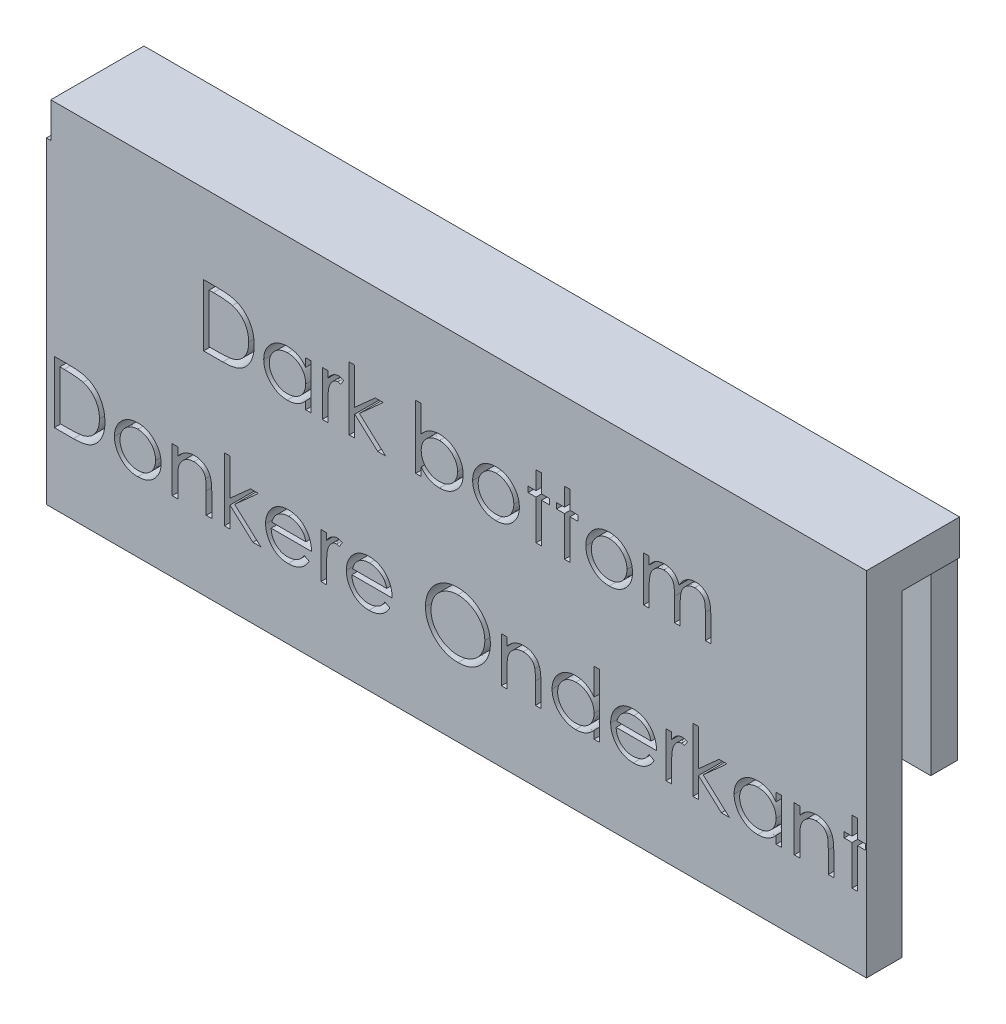
from build123d import *

# Parameters (mm, degrees)
SKETCH1_W           = 46.5
SKETCH1_H           = 18
BOSS_EXTRUDE1_DEPTH = 2
SKETCH3_W           = 46.138929178
SKETCH3_H           = 1.526595811
BOSS_EXTRUDE2_DEPTH = 10
SKETCH4_W           = 46.248898518
SKETCH4_H           = 5.280281263
BOSS_EXTRUDE3_DEPTH = 2
CUT_EXTRUDE1_DEPTH  = 3.753685452


with BuildPart() as part:
    # Sketch1 → Boss-Extrude1 (new body)
    with BuildSketch(Plane.XY):
        with Locations((32.25, 16)):
            Rectangle(SKETCH1_W, SKETCH1_H)
    extrude(amount=BOSS_EXTRUDE1_DEPTH)



with BuildPart() as body_2:
    # Sketch3 → Boss-Extrude2 (new body)
    with BuildSketch(Plane(origin=(0, 15, 0), x_dir=(1, 0, 0), z_dir=(0, 1, 0))):
        with Locations((32.320566071, 2.516983358)):
            Rectangle(SKETCH3_W, SKETCH3_H)
    extrude(amount=BOSS_EXTRUDE2_DEPTH)


with BuildPart() as part_1:
    add(part.part)

    add(body_2.part)  # Boss-Extrude3 merges body 2
    # Sketch4 → Boss-Extrude3 (add)
    with BuildSketch(Plane(origin=(0, 25, 0), x_dir=(1, 0, 0), z_dir=(0, 1, 0))):
        with Locations((32.375550741, 0.640140632)):
            Rectangle(SKETCH4_W, SKETCH4_H)
    extrude(amount=BOSS_EXTRUDE3_DEPTH)

    # Sketch5 → Cut-Extrude1 (cut)
    # profile 1 of 26: a face of its own
    with BuildSketch(Plane.XY.offset(2)):
        with BuildLine():
            Line((17.913461538, 19), (17.913461538, 22.5))
            Line((17.913461538, 22.5), (18.620192308, 22.5))
            add(Edge.make_bspline(
                [(18.620192308, 22.5), (18.738935275, 22.499512509), (18.910662422, 22.497019153), (19.13081444, 22.483682801), (19.276251438, 22.46973216), (19.408718512, 22.452535154), (19.560024022, 22.425420224), (19.665756057, 22.396814059), (19.730769231, 22.373798077)],
                knots=[0, 0, 0, 0, 0.317405911, 0.458843612, 0.589366542, 0.707831319, 0.815770031, 1, 1, 1, 1], degree=3))
            add(Edge.make_bspline(
                [(19.730769231, 22.373798077), (19.811480981, 22.345157912), (19.928357681, 22.29296722), (20.072657528, 22.205056909), (20.173889495, 22.132138506), (20.266686893, 22.049364142), (20.354695717, 21.960309757), (20.434310176, 21.861720678), (20.507218587, 21.755645893), (20.572954054, 21.643333784), (20.63009387, 21.524998694), (20.677545384, 21.401241468), (20.716948084, 21.272406377), (20.747957924, 21.13820978), (20.77680161, 20.94923016), (20.785778063, 20.8040153), (20.78525641, 20.705829327)],
                knots=[0, 0, 0, 0, 0.121694296, 0.181154855, 0.239875389, 0.298701942, 0.357647424, 0.417604843, 0.478494041, 0.540407051, 0.602344994, 0.665004328, 0.728559309, 0.793650542, 0.860534268, 1, 1, 1, 1], degree=3))
            add(Edge.make_bspline(
                [(20.78525641, 20.705829327), (20.785605107, 20.620548838), (20.778085758, 20.49457676), (20.756058161, 20.329763285), (20.731044445, 20.212157015), (20.700633998, 20.097828945), (20.661671932, 19.987996662), (20.617035887, 19.881652863), (20.564986154, 19.780235384), (20.507844731, 19.684152013), (20.446522997, 19.593576485), (20.381086299, 19.509801263), (20.310910667, 19.432572651), (20.23690295, 19.362007073), (20.15857862, 19.297515056), (20.075735569, 19.240358507), (19.988744846, 19.188291377), (19.895068717, 19.142871105), (19.792932852, 19.104440757), (19.681901669, 19.07259552), (19.562247731, 19.046019007), (19.433764178, 19.024964708), (19.244920373, 19.005425584), (19.098480684, 18.999474174), (18.998096955, 19)],
                knots=[0, 0, 0, 0, 0.0908068, 0.134295271, 0.177024386, 0.218822734, 0.260244116, 0.301079867, 0.341613894, 0.381583419, 0.420119591, 0.458074619, 0.494738488, 0.531194623, 0.566933698, 0.602712651, 0.638326606, 0.674853249, 0.713467371, 0.754441804, 0.797815361, 0.843989456, 0.89307157, 1, 1, 1, 1], degree=3))
            Line((18.998096955, 19), (17.913461538, 19))
        make_face()
        with BuildLine():
            Line((18.227564103, 19.358974359), (18.629306891, 19.358974359))
            add(Edge.make_bspline(
                [(18.629306891, 19.358974359), (18.740332183, 19.359028674), (18.900058036, 19.361146542), (19.103604604, 19.370737134), (19.235729964, 19.380292283), (19.354006396, 19.393005752), (19.484946242, 19.410493767), (19.575239747, 19.430822122), (19.629807692, 19.448016827)],
                knots=[0, 0, 0, 0, 0.330627932, 0.475548836, 0.60674619, 0.725023803, 0.829742387, 1, 1, 1, 1], degree=3))
            add(Edge.make_bspline(
                [(19.629807692, 19.448016827), (19.693089902, 19.469478593), (19.78629078, 19.505277121), (19.90052548, 19.570114463), (19.980638421, 19.623501573), (20.054964297, 19.684151626), (20.124388626, 19.750721523), (20.188770362, 19.823556593), (20.247444716, 19.902564674), (20.299952902, 19.98725449), (20.34542456, 20.076793324), (20.385274466, 20.170200112), (20.416559308, 20.26890936), (20.441050647, 20.37203807), (20.464733706, 20.517940332), (20.471183516, 20.630396916), (20.471153846, 20.706530449)],
                knots=[0, 0, 0, 0, 0.123338231, 0.183124538, 0.241782995, 0.300578883, 0.359680075, 0.418881641, 0.479530664, 0.540850536, 0.602303396, 0.664463212, 0.727805723, 0.792894815, 0.859672328, 1, 1, 1, 1], degree=3))
            add(Edge.make_bspline(
                [(20.471153846, 20.706530449), (20.472078892, 20.786969089), (20.463714782, 20.905465395), (20.43840747, 21.059349094), (20.411660168, 21.16832775), (20.377519808, 21.273015981), (20.334927646, 21.372835525), (20.28626037, 21.468840378), (20.228357214, 21.558814776), (20.16494155, 21.643907773), (20.094563773, 21.721863097), (20.018341399, 21.79285589), (19.937107793, 21.858000835), (19.848565994, 21.914643211), (19.721974007, 21.98320693), (19.619232692, 22.021083578), (19.549178686, 22.04286859)],
                knots=[0, 0, 0, 0, 0.137812606, 0.203226247, 0.267174055, 0.330024003, 0.391794272, 0.453084399, 0.514333908, 0.574999993, 0.634865483, 0.694116315, 0.753441622, 0.8131258, 0.874079686, 1, 1, 1, 1], degree=3))
            add(Edge.make_bspline(
                [(19.549178686, 22.04286859), (19.487160981, 22.061625538), (19.385746937, 22.08286318), (19.240954668, 22.103635061), (19.113067618, 22.117744295), (18.972025301, 22.12780531), (18.757512903, 22.138405599), (18.589836839, 22.141412816), (18.473657853, 22.141025641)],
                knots=[0, 0, 0, 0, 0.179284514, 0.286582528, 0.405111483, 0.535592873, 0.67819021, 1, 1, 1, 1], degree=3))
            Line((18.473657853, 22.141025641), (18.227564103, 22.141025641))
            Line((18.227564103, 22.141025641), (18.227564103, 19.358974359))
        make_face(mode=Mode.SUBTRACT)
    # profile 2 of 26: a face of its own
    with BuildSketch(Plane.XY.offset(2)):
        with BuildLine():
            Line((24.016025641, 21.557692308), (24.016025641, 19))
            Line((24.016025641, 19), (23.701923077, 19))
            Line((23.701923077, 19), (23.701923077, 19.442407853))
            add(Edge.make_bspline(
                [(23.701923077, 19.442407853), (23.634685522, 19.362956656), (23.526174571, 19.252427181), (23.35954698, 19.137793014), (23.230880701, 19.069601901), (23.095953495, 19.018478013), (22.905900639, 18.969058407), (22.757487782, 18.954320855), (22.657251603, 18.955128205)],
                knots=[0, 0, 0, 0, 0.262084975, 0.386269912, 0.507164597, 0.627300236, 0.748144942, 1, 1, 1, 1], degree=3))
            add(Edge.make_bspline(
                [(22.657251603, 18.955128205), (22.568222191, 18.955346305), (22.43595508, 18.966840713), (22.265888436, 19.007700185), (22.144614725, 19.04955776), (22.028942351, 19.105150147), (21.917882313, 19.171688245), (21.81200962, 19.250929941), (21.712938021, 19.34151773), (21.621706259, 19.439912778), (21.541644126, 19.544858321), (21.474894177, 19.655900583), (21.419062496, 19.77163391), (21.376109451, 19.892948179), (21.335432875, 20.06365536), (21.323925941, 20.196351016), (21.323717949, 20.285857372)],
                knots=[0, 0, 0, 0, 0.127433484, 0.189004127, 0.249930071, 0.310668454, 0.372328961, 0.43493911, 0.499575544, 0.564191208, 0.626735217, 0.688109334, 0.749293607, 0.810330528, 0.87190117, 1, 1, 1, 1], degree=3))
            add(Edge.make_bspline(
                [(21.323717949, 20.285857372), (21.324235602, 20.373675136), (21.334967077, 20.504289686), (21.376962908, 20.672021703), (21.420471875, 20.791376968), (21.476324222, 20.905717466), (21.544249481, 21.015121372), (21.624269391, 21.11989079), (21.716521582, 21.217562059), (21.816456403, 21.307782484), (21.923365149, 21.386192224), (22.034588324, 21.453906554), (22.15185174, 21.507569328), (22.27341732, 21.550943593), (22.444629954, 21.591623077), (22.577654075, 21.601766481), (22.667067308, 21.602564103)],
                knots=[0, 0, 0, 0, 0.12607881, 0.186904093, 0.247573935, 0.308003356, 0.369131898, 0.432033228, 0.496790794, 0.561610823, 0.624913866, 0.686726349, 0.748078833, 0.809582291, 0.871630743, 1, 1, 1, 1], degree=3))
            add(Edge.make_bspline(
                [(22.667067308, 21.602564103), (22.769259991, 21.602265133), (22.921003322, 21.589145068), (23.113001098, 21.535166133), (23.247664174, 21.4813045), (23.374800723, 21.409613684), (23.536723724, 21.286459543), (23.639993122, 21.169392968), (23.701923077, 21.084435096)],
                knots=[0, 0, 0, 0, 0.254653531, 0.376014554, 0.495255252, 0.614797719, 0.738105554, 1, 1, 1, 1], degree=3))
            Line((23.701923077, 21.084435096), (23.701923077, 21.557692308))
            Line((23.701923077, 21.557692308), (24.016025641, 21.557692308))
        make_face()
        with BuildLine():
            add(Edge.make_bspline(
                [(22.671274038, 21.288461538), (22.580773028, 21.288066301), (22.445397691, 21.273049824), (22.27437266, 21.216499445), (22.153429062, 21.159275626), (22.040760606, 21.08723138), (21.940065441, 21.000114154), (21.850529015, 20.900275853), (21.775196568, 20.788174735), (21.713895471, 20.667994021), (21.656034983, 20.500877014), (21.636666942, 20.369829919), (21.637820513, 20.282351763)],
                knots=[0, 0, 0, 0, 0.169593435, 0.252475515, 0.336244477, 0.419504521, 0.502035907, 0.584774648, 0.669846475, 0.754184866, 0.836658238, 1, 1, 1, 1], degree=3))
            add(Edge.make_bspline(
                [(21.637820513, 20.282351763), (21.638568505, 20.195443041), (21.655199912, 20.063917538), (21.715090834, 19.89711593), (21.776266206, 19.775857087), (21.852970869, 19.663272773), (21.941854791, 19.561531369), (22.043806399, 19.474047092), (22.15673328, 19.400789331), (22.277342409, 19.341701907), (22.4468109, 19.286329667), (22.579567135, 19.268811102), (22.668469551, 19.269230769)],
                knots=[0, 0, 0, 0, 0.162858895, 0.245483689, 0.330807139, 0.416493374, 0.499893203, 0.583048156, 0.667157852, 0.751311929, 0.833784789, 1, 1, 1, 1], degree=3))
            add(Edge.make_bspline(
                [(22.668469551, 19.269230769), (22.758781926, 19.26961823), (22.894406502, 19.285241704), (23.067239581, 19.341291483), (23.191025257, 19.399128264), (23.306341535, 19.470902172), (23.409840332, 19.554905054), (23.497352578, 19.652609076), (23.571559197, 19.759986262), (23.629681866, 19.877694462), (23.687216033, 20.047084464), (23.701441336, 20.182569903), (23.701923077, 20.273237179)],
                knots=[0, 0, 0, 0, 0.16866354, 0.252551924, 0.338239689, 0.423102661, 0.505556051, 0.586175656, 0.66713572, 0.74849918, 0.830452399, 1, 1, 1, 1], degree=3))
            add(Edge.make_bspline(
                [(23.701923077, 20.273237179), (23.701726261, 20.342764732), (23.692875432, 20.445820513), (23.661663282, 20.57799272), (23.629349665, 20.671434861), (23.586849725, 20.760070021), (23.535604296, 20.844533747), (23.474698208, 20.924386952), (23.40511569, 20.998530084), (23.328950434, 21.066156311), (23.248355926, 21.12652141), (23.162377103, 21.176107042), (23.072460335, 21.217159938), (22.978447985, 21.24977498), (22.844819999, 21.279451284), (22.741372597, 21.289480206), (22.671274038, 21.288461538)],
                knots=[0, 0, 0, 0, 0.129188088, 0.191218683, 0.251912818, 0.312507474, 0.373494434, 0.4351516, 0.498741474, 0.562095217, 0.624186567, 0.685475718, 0.746096815, 0.807611636, 0.869966581, 1, 1, 1, 1], degree=3))
        make_face(mode=Mode.SUBTRACT)
    # profile 3 of 26: a face of its own
    with BuildSketch(Plane.XY.offset(2)):
        with BuildLine():
            Line((24.644230769, 21.557692308), (24.958333333, 21.557692308))
            Line((24.958333333, 21.557692308), (24.958333333, 21.181189904))
            add(Edge.make_bspline(
                [(24.958333333, 21.181189904), (25.001353461, 21.248903863), (25.069305664, 21.342671547), (25.175102557, 21.445362608), (25.25273842, 21.503890887), (25.333119451, 21.547651227), (25.440692743, 21.590328436), (25.526251338, 21.602175086), (25.582331731, 21.602564103)],
                knots=[0, 0, 0, 0, 0.306112383, 0.438366514, 0.560541455, 0.675317225, 0.786113634, 1, 1, 1, 1], degree=3))
            add(Edge.make_bspline(
                [(25.582331731, 21.602564103), (25.627308184, 21.602214682), (25.723775014, 21.58532168), (25.811428126, 21.541783769), (25.855769231, 21.514923878)],
                knots=[0, 0, 0, 0, 0.463523195, 1, 1, 1, 1], degree=3))
            Line((25.855769231, 21.514923878), (25.683293269, 21.242888622))
            add(Edge.make_bspline(
                [(25.683293269, 21.242888622), (25.654680231, 21.255558956), (25.603207573, 21.278814594), (25.547420418, 21.28813915), (25.522736378, 21.288461538)],
                knots=[0, 0, 0, 0, 0.560229945, 1, 1, 1, 1], degree=3))
            add(Edge.make_bspline(
                [(25.522736378, 21.288461538), (25.471211353, 21.288528061), (25.392332103, 21.269650379), (25.297388991, 21.212815066), (25.239214536, 21.164630107), (25.194172727, 21.118069574), (25.1620323, 21.077423986), (25.132550023, 21.031844468), (25.104377984, 20.982115392), (25.078719051, 20.927383947), (25.045867612, 20.846329102), (25.026346224, 20.781851222), (25.014423077, 20.737379808)],
                knots=[0, 0, 0, 0, 0.191338128, 0.295190617, 0.410312337, 0.471930251, 0.536425159, 0.603118728, 0.674117672, 0.749332023, 0.828283384, 1, 1, 1, 1], degree=3))
            add(Edge.make_bspline(
                [(25.014423077, 20.737379808), (25.002673258, 20.692721974), (24.991209304, 20.617549912), (24.978985544, 20.507810529), (24.971837378, 20.404873905), (24.965284226, 20.28825817), (24.960009948, 20.105002592), (24.957786876, 19.960555982), (24.958333333, 19.859575321)],
                knots=[0, 0, 0, 0, 0.15693815, 0.258600395, 0.37589093, 0.508166168, 0.656237809, 1, 1, 1, 1], degree=3))
            Line((24.958333333, 19.859575321), (24.958333333, 19))
            Line((24.958333333, 19), (24.644230769, 19))
            Line((24.644230769, 19), (24.644230769, 21.557692308))
        make_face()
    # profile 4 of 26: a face of its own
    with BuildSketch(Plane.XY.offset(2)):
        Polygon((26.169871795, 22.58974359), (26.483974359, 22.58974359), (26.483974359, 20.514423077), (27.647836538, 21.557692308), (28.099358974, 21.557692308), (26.748998397, 20.346153846), (28.233974359, 19), (27.783153045, 19), (26.483974359, 20.178585737), (26.483974359, 19), (26.169871795, 19), align=None)
    # profile 5 of 26: a face of its own
    with BuildSketch(Plane.XY.offset(2)):
        with BuildLine():
            Line((29.939102564, 19), (29.939102564, 22.58974359))
            Line((29.939102564, 22.58974359), (30.253205128, 22.58974359))
            Line((30.253205128, 22.58974359), (30.253205128, 21.093549679))
            add(Edge.make_bspline(
                [(30.253205128, 21.093549679), (30.320093385, 21.174726637), (30.429514584, 21.28609761), (30.59486645, 21.405700341), (30.722784928, 21.478332725), (30.857486124, 21.533541487), (31.047116913, 21.588296906), (31.196276936, 21.602646779), (31.296474359, 21.602564103)],
                knots=[0, 0, 0, 0, 0.262680826, 0.387189654, 0.508389693, 0.628966193, 0.749723188, 1, 1, 1, 1], degree=3))
            add(Edge.make_bspline(
                [(31.296474359, 21.602564103), (31.385721969, 21.602241385), (31.518250778, 21.590937194), (31.688537901, 21.549986408), (31.809812498, 21.50813603), (31.92548491, 21.452541891), (32.036543896, 21.386003624), (32.142420884, 21.306764458), (32.241475831, 21.21616638), (32.332769468, 21.117809696), (32.412682879, 21.012629391), (32.480179297, 20.902154318), (32.536022649, 20.786754177), (32.579148698, 20.665958123), (32.619559011, 20.495642678), (32.631334081, 20.363235864), (32.631410256, 20.273938301)],
                knots=[0, 0, 0, 0, 0.127821334, 0.189419252, 0.250372186, 0.311137475, 0.372825298, 0.435463182, 0.50012825, 0.564772537, 0.627344253, 0.688919446, 0.7498292, 0.810577905, 0.872175822, 1, 1, 1, 1], degree=3))
            add(Edge.make_bspline(
                [(32.631410256, 20.273938301), (32.63103747, 20.185857075), (32.619996145, 20.054862411), (32.578335913, 19.886550693), (32.534415616, 19.766903627), (32.479139721, 19.651883395), (32.410031425, 19.542803074), (32.3302196, 19.437764087), (32.237888679, 19.340140413), (32.137975073, 19.249907196), (32.031060812, 19.171500664), (31.919839009, 19.10378596), (31.802575446, 19.050121595), (31.6810091, 19.006754085), (31.509575001, 18.965986067), (31.376291385, 18.956026327), (31.286658654, 18.955128205)],
                knots=[0, 0, 0, 0, 0.126227996, 0.187288763, 0.247869473, 0.308511206, 0.369726883, 0.432535801, 0.49719823, 0.561923029, 0.62513307, 0.686854743, 0.748117091, 0.809530192, 0.871487485, 1, 1, 1, 1], degree=3))
            add(Edge.make_bspline(
                [(31.286658654, 18.955128205), (31.184952487, 18.955473239), (31.033832797, 18.968455719), (30.84266405, 19.022712978), (30.707940266, 19.076221362), (30.581548697, 19.14878449), (30.419132397, 19.271355349), (30.316395122, 19.389013727), (30.253205128, 19.473257212)],
                knots=[0, 0, 0, 0, 0.253879762, 0.37486255, 0.494282856, 0.614292714, 0.736970281, 1, 1, 1, 1], degree=3))
            Line((30.253205128, 19.473257212), (30.253205128, 19))
            Line((30.253205128, 19), (29.939102564, 19))
        make_face()
        with BuildLine():
            add(Edge.make_bspline(
                [(31.283854167, 19.269230769), (31.374355396, 19.269625875), (31.50973009, 19.28464274), (31.680756168, 19.341192486), (31.801696784, 19.398418109), (31.914376315, 19.470455659), (32.015030515, 19.55759765), (32.104503696, 19.657100531), (32.179180526, 19.76933293), (32.241413509, 19.88878767), (32.298834365, 20.055977384), (32.318678066, 20.186625209), (32.317307692, 20.273938301)],
                knots=[0, 0, 0, 0, 0.169735574, 0.252687118, 0.336526289, 0.419856114, 0.502456671, 0.585264756, 0.669799831, 0.754407469, 0.836949963, 1, 1, 1, 1], degree=3))
            add(Edge.make_bspline(
                [(32.317307692, 20.273938301), (32.316215907, 20.361195405), (32.300639841, 20.493602179), (32.239172628, 20.660450754), (32.178114133, 20.781624425), (32.102230086, 20.894633009), (32.013228358, 20.996124318), (31.911345305, 21.083678834), (31.79852268, 21.156689793), (31.678340584, 21.216171838), (31.509416065, 21.271101645), (31.377242831, 21.28899783), (31.288762019, 21.288461538)],
                knots=[0, 0, 0, 0, 0.163804915, 0.246617502, 0.331982974, 0.417466241, 0.500907145, 0.584103052, 0.668254172, 0.752056082, 0.83456956, 1, 1, 1, 1], degree=3))
            add(Edge.make_bspline(
                [(31.288762019, 21.288461538), (31.198439171, 21.289011013), (31.063284979, 21.271051445), (30.889820596, 21.215921166), (30.765531271, 21.157068552), (30.649677968, 21.084936191), (30.546064174, 21.000201309), (30.456736535, 20.903420222), (30.383178264, 20.794913958), (30.324827521, 20.677731945), (30.26810586, 20.508829989), (30.253646183, 20.374229084), (30.253205128, 20.283754006)],
                knots=[0, 0, 0, 0, 0.168181784, 0.252418528, 0.338617797, 0.424014102, 0.506401971, 0.587545174, 0.668800722, 0.750099527, 0.83102227, 1, 1, 1, 1], degree=3))
            add(Edge.make_bspline(
                [(30.253205128, 20.283754006), (30.253402155, 20.214226635), (30.26225237, 20.111170326), (30.293465496, 19.97899896), (30.325776441, 19.885554515), (30.368286331, 19.79692793), (30.419494259, 19.712431885), (30.480446544, 19.632828613), (30.549352956, 19.558313232), (30.62531539, 19.490504054), (30.706838474, 19.431724966), (30.792256489, 19.381113924), (30.882546155, 19.34075733), (30.976658596, 19.307875238), (31.110323362, 19.278270523), (31.213747684, 19.26819668), (31.283854167, 19.269230769)],
                knots=[0, 0, 0, 0, 0.129211511, 0.191253353, 0.251958493, 0.312564136, 0.373562153, 0.435230498, 0.498536174, 0.561901403, 0.62409808, 0.685023397, 0.746050779, 0.807576754, 0.869943004, 1, 1, 1, 1], degree=3))
        make_face(mode=Mode.SUBTRACT)
    # profile 6 of 26: a face of its own
    with BuildSketch(Plane.XY.offset(2)):
        Polygon((36.759615385, 22.58974359), (37.073717949, 22.58974359), (37.073717949, 21.557692308), (37.522435897, 21.557692308), (37.522435897, 21.243589744), (37.073717949, 21.243589744), (37.073717949, 19), (36.759615385, 19), (36.759615385, 21.243589744), (36.310897436, 21.243589744), (36.310897436, 21.557692308), (36.759615385, 21.557692308), align=None)
    # profile 7 of 26: a face of its own
    with BuildSketch(Plane.XY.offset(2)):
        Polygon((38.375, 22.58974359), (38.689102564, 22.58974359), (38.689102564, 21.557692308), (39.137820513, 21.557692308), (39.137820513, 21.243589744), (38.689102564, 21.243589744), (38.689102564, 19), (38.375, 19), (38.375, 21.243589744), (37.926282051, 21.243589744), (37.926282051, 21.557692308), (38.375, 21.557692308), align=None)
    # profile 8 of 26: a face of its own
    with BuildSketch(Plane.XY.offset(2)):
        with BuildLine():
            Line((42.862179487, 21.557692308), (43.176282051, 21.557692308))
            Line((43.176282051, 21.557692308), (43.176282051, 21.11318109))
            add(Edge.make_bspline(
                [(43.176282051, 21.11318109), (43.228967486, 21.188629132), (43.335353942, 21.321506703), (43.465363263, 21.431636251), (43.531049679, 21.472856571)],
                knots=[0, 0, 0, 0, 0.543394841, 1, 1, 1, 1], degree=3))
            add(Edge.make_bspline(
                [(43.531049679, 21.472856571), (43.612638903, 21.514986205), (43.784454477, 21.581671125), (43.967587986, 21.601868466), (44.058293269, 21.602564103)],
                knots=[0, 0, 0, 0, 0.50303512, 1, 1, 1, 1], degree=3))
            add(Edge.make_bspline(
                [(44.058293269, 21.602564103), (44.119353465, 21.601777749), (44.210977657, 21.594025606), (44.328765773, 21.562703093), (44.413378267, 21.530322279), (44.493099272, 21.491068599), (44.566188662, 21.445020722), (44.63181184, 21.393322953), (44.689941766, 21.33364503), (44.742195251, 21.264304823), (44.809943588, 21.150538679), (44.848747116, 21.053489094), (44.872295673, 20.984875801)],
                knots=[0, 0, 0, 0, 0.16653232, 0.248836331, 0.331246145, 0.412957109, 0.490494278, 0.566155792, 0.639987335, 0.716765488, 0.802143905, 1, 1, 1, 1], degree=3))
            add(Edge.make_bspline(
                [(44.872295673, 20.984875801), (44.898418077, 21.033988739), (44.941446272, 21.104390338), (45.005775126, 21.191512536), (45.055793306, 21.251527714), (45.108222123, 21.306835024), (45.163282434, 21.357632094), (45.220667472, 21.404130015), (45.300459768, 21.458463617), (45.40427133, 21.516088457), (45.578840431, 21.58322047), (45.718033923, 21.602786322), (45.810396635, 21.602564103)],
                knots=[0, 0, 0, 0, 0.141225536, 0.209115852, 0.274839653, 0.33948293, 0.402476267, 0.464941889, 0.526832641, 0.647414816, 0.765561512, 1, 1, 1, 1], degree=3))
            add(Edge.make_bspline(
                [(45.810396635, 21.602564103), (45.894061311, 21.601943586), (46.019076921, 21.588229848), (46.173324342, 21.530211451), (46.27879637, 21.472027506), (46.373957526, 21.398835106), (46.456673478, 21.311769798), (46.526443934, 21.211426206), (46.572022569, 21.117034463), (46.602937791, 21.033699095), (46.621999186, 20.962692811), (46.638838195, 20.884541258), (46.652822339, 20.799150988), (46.663028782, 20.706220419), (46.673554146, 20.567675628), (46.676671966, 20.459779664), (46.676282051, 20.385416667)],
                knots=[0, 0, 0, 0, 0.147965015, 0.218796999, 0.289470445, 0.359724218, 0.429707739, 0.50049652, 0.57442902, 0.613947296, 0.65715527, 0.70397277, 0.754938985, 0.809706611, 0.868832954, 1, 1, 1, 1], degree=3))
            Line((46.676282051, 20.385416667), (46.676282051, 19))
            Line((46.676282051, 19), (46.362179487, 19))
            Line((46.362179487, 19), (46.362179487, 20.38681891))
            add(Edge.make_bspline(
                [(46.362179487, 20.38681891), (46.362250824, 20.449688534), (46.361290295, 20.540014141), (46.35418032, 20.654944432), (46.348248944, 20.729116309), (46.340004396, 20.795365144), (46.329358629, 20.853557554), (46.318080914, 20.904151362), (46.29934493, 20.960237434), (46.269397044, 21.022107472), (46.223779528, 21.088831751), (46.166309561, 21.146909905), (46.099948858, 21.197338561), (46.024402534, 21.238292124), (45.910547623, 21.278533198), (45.818215169, 21.28886205), (45.755709135, 21.288461538)],
                knots=[0, 0, 0, 0, 0.150563303, 0.216151057, 0.275679792, 0.32870705, 0.375904435, 0.417301898, 0.452692748, 0.517265292, 0.581216568, 0.645321894, 0.712024493, 0.780130045, 0.850218226, 1, 1, 1, 1], degree=3))
            add(Edge.make_bspline(
                [(45.755709135, 21.288461538), (45.677171953, 21.289807606), (45.560169743, 21.270526633), (45.413222045, 21.212522061), (45.311004013, 21.150179093), (45.216977006, 21.075346527), (45.136077221, 20.986403333), (45.069245092, 20.885771666), (45.023991101, 20.792625398), (44.995401804, 20.708955892), (44.976524878, 20.635858529), (44.961841531, 20.552776985), (44.948070807, 20.460269368), (44.939083917, 20.357699738), (44.927718767, 20.201711949), (44.926761876, 20.07948259), (44.926282051, 19.994891827)],
                knots=[0, 0, 0, 0, 0.134706602, 0.201864998, 0.270788266, 0.340024294, 0.408082739, 0.476813195, 0.547346064, 0.585639795, 0.628864953, 0.677153203, 0.730802811, 0.789806616, 0.854325009, 1, 1, 1, 1], degree=3))
            Line((44.926282051, 19.994891827), (44.926282051, 19))
            Line((44.926282051, 19), (44.612179487, 19))
            Line((44.612179487, 19), (44.612179487, 20.300580929))
            add(Edge.make_bspline(
                [(44.612179487, 20.300580929), (44.612235703, 20.371161164), (44.611311, 20.472462526), (44.604181812, 20.601183428), (44.598304316, 20.684004687), (44.589843449, 20.757416061), (44.580233838, 20.821810811), (44.568885195, 20.877027558), (44.550095316, 20.937590966), (44.521380862, 21.004311735), (44.475192531, 21.075453374), (44.417585214, 21.137719166), (44.350013324, 21.190886771), (44.274011536, 21.234794246), (44.159633037, 21.27808312), (44.066274887, 21.287934372), (44.003605769, 21.288461538)],
                knots=[0, 0, 0, 0, 0.158778855, 0.227738062, 0.289945653, 0.345498839, 0.393896337, 0.436373785, 0.472122274, 0.536383616, 0.599077902, 0.661948234, 0.726310542, 0.791771103, 0.858647304, 1, 1, 1, 1], degree=3))
            add(Edge.make_bspline(
                [(44.003605769, 21.288461538), (43.927797846, 21.289094052), (43.813861913, 21.270895166), (43.671037697, 21.213358139), (43.569082039, 21.153780477), (43.475408154, 21.079858965), (43.393399814, 20.992950046), (43.324457318, 20.894099392), (43.278725464, 20.801935283), (43.249227065, 20.720361947), (43.229631468, 20.651011021), (43.212792978, 20.574010732), (43.200274143, 20.489123779), (43.188213925, 20.396902028), (43.180020885, 20.25837498), (43.175286196, 20.150635736), (43.176282051, 20.076221955)],
                knots=[0, 0, 0, 0, 0.136870959, 0.206114357, 0.277538182, 0.349771978, 0.421250836, 0.492910757, 0.567026589, 0.606614153, 0.649703954, 0.69730315, 0.74908566, 0.804880647, 0.865485006, 1, 1, 1, 1], degree=3))
            Line((43.176282051, 20.076221955), (43.176282051, 19))
            Line((43.176282051, 19), (42.862179487, 19))
            Line((42.862179487, 19), (42.862179487, 21.557692308))
        make_face()
    # profile 9 of 26: a face of its own
    with BuildSketch(Plane.XY.offset(2)):
        with BuildLine():
            Line((9.448717949, 11), (9.448717949, 14.5))
            Line((9.448717949, 14.5), (10.155448718, 14.5))
            add(Edge.make_bspline(
                [(10.155448718, 14.5), (10.274191685, 14.499512509), (10.445918832, 14.497019153), (10.66607085, 14.483682801), (10.811507848, 14.46973216), (10.943974922, 14.452535154), (11.095280432, 14.425420224), (11.201012467, 14.396814059), (11.266025641, 14.373798077)],
                knots=[0, 0, 0, 0, 0.317405911, 0.458843612, 0.589366542, 0.707831319, 0.815770031, 1, 1, 1, 1], degree=3))
            add(Edge.make_bspline(
                [(11.266025641, 14.373798077), (11.346737391, 14.345157912), (11.463614091, 14.29296722), (11.607913938, 14.205056909), (11.709145906, 14.132138506), (11.801943303, 14.049364142), (11.889952127, 13.960309757), (11.969566586, 13.861720678), (12.042474997, 13.755645893), (12.108210464, 13.643333784), (12.16535028, 13.524998694), (12.212801795, 13.401241468), (12.252204494, 13.272406377), (12.283214334, 13.13820978), (12.312058021, 12.94923016), (12.321034474, 12.8040153), (12.320512821, 12.705829327)],
                knots=[0, 0, 0, 0, 0.121694296, 0.181154855, 0.239875389, 0.298701942, 0.357647424, 0.417604843, 0.478494041, 0.540407051, 0.602344994, 0.665004328, 0.728559309, 0.793650542, 0.860534268, 1, 1, 1, 1], degree=3))
            add(Edge.make_bspline(
                [(12.320512821, 12.705829327), (12.320861517, 12.620548838), (12.313342168, 12.49457676), (12.291314572, 12.329763285), (12.266300855, 12.212157015), (12.235890408, 12.097828945), (12.196928342, 11.987996662), (12.152292298, 11.881652863), (12.100242564, 11.780235384), (12.043101141, 11.684152013), (11.981779408, 11.593576485), (11.91634271, 11.509801263), (11.846167077, 11.432572651), (11.772159361, 11.362007073), (11.69383503, 11.297515056), (11.610991979, 11.240358507), (11.524001257, 11.188291377), (11.430325127, 11.142871105), (11.328189262, 11.104440757), (11.21715808, 11.07259552), (11.097504141, 11.046019007), (10.969020588, 11.024964708), (10.780176783, 11.005425584), (10.633737094, 10.999474174), (10.533353365, 11)],
                knots=[0, 0, 0, 0, 0.0908068, 0.134295271, 0.177024386, 0.218822734, 0.260244116, 0.301079867, 0.341613894, 0.381583419, 0.420119591, 0.458074619, 0.494738488, 0.531194623, 0.566933698, 0.602712651, 0.638326606, 0.674853249, 0.713467371, 0.754441804, 0.797815361, 0.843989456, 0.89307157, 1, 1, 1, 1], degree=3))
            Line((10.533353365, 11), (9.448717949, 11))
        make_face()
        with BuildLine():
            Line((9.762820513, 11.358974359), (10.164563301, 11.358974359))
            add(Edge.make_bspline(
                [(10.164563301, 11.358974359), (10.275588593, 11.359028674), (10.435314447, 11.361146542), (10.638861014, 11.370737134), (10.770986374, 11.380292283), (10.889262806, 11.393005752), (11.020202653, 11.410493767), (11.110496157, 11.430822122), (11.165064103, 11.448016827)],
                knots=[0, 0, 0, 0, 0.330627932, 0.475548836, 0.60674619, 0.725023803, 0.829742387, 1, 1, 1, 1], degree=3))
            add(Edge.make_bspline(
                [(11.165064103, 11.448016827), (11.228346312, 11.469478593), (11.32154719, 11.505277121), (11.43578189, 11.570114463), (11.515894832, 11.623501573), (11.590220707, 11.684151626), (11.659645036, 11.750721523), (11.724026773, 11.823556593), (11.782701126, 11.902564674), (11.835209312, 11.98725449), (11.880680971, 12.076793324), (11.920530877, 12.170200112), (11.951815718, 12.26890936), (11.976307057, 12.37203807), (11.999990117, 12.517940332), (12.006439926, 12.630396916), (12.006410256, 12.706530449)],
                knots=[0, 0, 0, 0, 0.123338231, 0.183124538, 0.241782995, 0.300578883, 0.359680075, 0.418881641, 0.479530664, 0.540850536, 0.602303396, 0.664463212, 0.727805723, 0.792894815, 0.859672328, 1, 1, 1, 1], degree=3))
            add(Edge.make_bspline(
                [(12.006410256, 12.706530449), (12.007335302, 12.786969089), (11.998971193, 12.905465395), (11.97366388, 13.059349094), (11.946916578, 13.16832775), (11.912776218, 13.273015981), (11.870184057, 13.372835525), (11.82151678, 13.468840378), (11.763613625, 13.558814776), (11.70019796, 13.643907773), (11.629820183, 13.721863097), (11.553597809, 13.79285589), (11.472364203, 13.858000835), (11.383822405, 13.914643211), (11.257230417, 13.98320693), (11.154489103, 14.021083578), (11.084435096, 14.04286859)],
                knots=[0, 0, 0, 0, 0.137812606, 0.203226247, 0.267174055, 0.330024003, 0.391794272, 0.453084399, 0.514333908, 0.574999993, 0.634865483, 0.694116315, 0.753441622, 0.8131258, 0.874079686, 1, 1, 1, 1], degree=3))
            add(Edge.make_bspline(
                [(11.084435096, 14.04286859), (11.022417391, 14.061625538), (10.921003347, 14.08286318), (10.776211079, 14.103635061), (10.648324028, 14.117744295), (10.507281711, 14.12780531), (10.292769314, 14.138405599), (10.12509325, 14.141412816), (10.008914263, 14.141025641)],
                knots=[0, 0, 0, 0, 0.179284514, 0.286582528, 0.405111483, 0.535592873, 0.67819021, 1, 1, 1, 1], degree=3))
            Line((10.008914263, 14.141025641), (9.762820513, 14.141025641))
            Line((9.762820513, 14.141025641), (9.762820513, 11.358974359))
        make_face(mode=Mode.SUBTRACT)
    # profile 10 of 26: a face of its own
    with BuildSketch(Plane.XY.offset(2)):
        with BuildLine():
            Line((16.134615385, 13.557692308), (16.448717949, 13.557692308))
            Line((16.448717949, 13.557692308), (16.448717949, 13.096354167))
            add(Edge.make_bspline(
                [(16.448717949, 13.096354167), (16.512074753, 13.178561429), (16.612969531, 13.293482032), (16.77028857, 13.414042851), (16.890261116, 13.48417829), (17.015889599, 13.536969533), (17.191391528, 13.588560133), (17.329425322, 13.602087862), (17.421875, 13.602564103)],
                knots=[0, 0, 0, 0, 0.273568781, 0.398988314, 0.519929781, 0.638110022, 0.756588901, 1, 1, 1, 1], degree=3))
            add(Edge.make_bspline(
                [(17.421875, 13.602564103), (17.514250646, 13.601952327), (17.652126786, 13.586949854), (17.822698586, 13.524198046), (17.939313045, 13.461040562), (18.044441605, 13.382419655), (18.136766105, 13.29084566), (18.213129439, 13.185508562), (18.264326805, 13.087785657), (18.298052398, 13.001096827), (18.319284943, 12.926850085), (18.337315031, 12.844131931), (18.352950603, 12.753192343), (18.363511568, 12.653394152), (18.375144336, 12.503667574), (18.378985081, 12.386876607), (18.378205128, 12.306189904)],
                knots=[0, 0, 0, 0, 0.15117814, 0.223487984, 0.295542644, 0.366976255, 0.437130525, 0.507043616, 0.578559734, 0.616613545, 0.658756237, 0.704491226, 0.754803115, 0.809331625, 0.868274455, 1, 1, 1, 1], degree=3))
            Line((18.378205128, 12.306189904), (18.378205128, 11))
            Line((18.378205128, 11), (18.064102564, 11))
            Line((18.064102564, 11), (18.064102564, 12.203125))
            add(Edge.make_bspline(
                [(18.064102564, 12.203125), (18.063607992, 12.269728048), (18.063496624, 12.365119248), (18.059564303, 12.486412205), (18.05562044, 12.563810846), (18.049822554, 12.632040497), (18.042470824, 12.705037027), (18.034005744, 12.755000164), (18.026943109, 12.78505609)],
                knots=[0, 0, 0, 0, 0.342109649, 0.489825663, 0.623254428, 0.740079676, 0.841482673, 1, 1, 1, 1], degree=3))
            add(Edge.make_bspline(
                [(18.026943109, 12.78505609), (18.009420808, 12.861862731), (17.969744817, 12.971486264), (17.881478799, 13.093063722), (17.803630722, 13.165259607), (17.712391311, 13.221380411), (17.567970621, 13.275604328), (17.448838866, 13.288925676), (17.3671875, 13.288461538)],
                knots=[0, 0, 0, 0, 0.260833163, 0.378476029, 0.493177646, 0.609280965, 0.729981038, 1, 1, 1, 1], degree=3))
            add(Edge.make_bspline(
                [(17.3671875, 13.288461538), (17.317212359, 13.288700689), (17.242478573, 13.283005848), (17.145841118, 13.26211501), (17.075421493, 13.241270212), (17.007913543, 13.212601504), (16.941149292, 13.180073878), (16.877642525, 13.139525185), (16.816039097, 13.094334704), (16.758726415, 13.044255429), (16.705397621, 12.991411045), (16.657861264, 12.93513501), (16.614786482, 12.876336637), (16.57763074, 12.814198995), (16.534109206, 12.727466923), (16.509684654, 12.658434733), (16.497095353, 12.611177885)],
                knots=[0, 0, 0, 0, 0.126626858, 0.188984372, 0.250230194, 0.312351163, 0.374573618, 0.438147531, 0.502920413, 0.567974095, 0.630771334, 0.692934609, 0.754397534, 0.815218352, 0.876116925, 1, 1, 1, 1], degree=3))
            add(Edge.make_bspline(
                [(16.497095353, 12.611177885), (16.487740038, 12.573780116), (16.477302239, 12.512304593), (16.466929562, 12.423400123), (16.459865376, 12.34251367), (16.455566146, 12.251754193), (16.449013935, 12.111594755), (16.449186365, 12.001423166), (16.448717949, 11.924779647)],
                knots=[0, 0, 0, 0, 0.167615077, 0.271052394, 0.389459503, 0.520842802, 0.666398759, 1, 1, 1, 1], degree=3))
            Line((16.448717949, 11.924779647), (16.448717949, 11))
            Line((16.448717949, 11), (16.134615385, 11))
            Line((16.134615385, 11), (16.134615385, 13.557692308))
        make_face()
    # profile 11 of 26: a face of its own
    with BuildSketch(Plane.XY.offset(2)):
        Polygon((19.096153846, 14.58974359), (19.41025641, 14.58974359), (19.41025641, 12.514423077), (20.57411859, 13.557692308), (21.025641026, 13.557692308), (19.675280449, 12.346153846), (21.16025641, 11), (20.709435096, 11), (19.41025641, 12.178585737), (19.41025641, 11), (19.096153846, 11), align=None)
    # profile 12 of 26: a face of its own
    with BuildSketch(Plane.XY.offset(2)):
        with BuildLine():
            Line((23.618389423, 11.807692308), (23.897435897, 11.661157853))
            add(Edge.make_bspline(
                [(23.897435897, 11.661157853), (23.855935061, 11.583465218), (23.786464071, 11.474469332), (23.679518186, 11.344707178), (23.594445194, 11.262960759), (23.504767588, 11.19171381), (23.410037001, 11.129374293), (23.309747685, 11.076258211), (23.203897869, 11.031497519), (23.091599219, 10.997119284), (22.929215947, 10.963793586), (22.802339465, 10.955139365), (22.716045673, 10.955128205)],
                knots=[0, 0, 0, 0, 0.181660766, 0.265874227, 0.346354784, 0.424599862, 0.501903184, 0.579992091, 0.658443431, 0.738672236, 0.821894148, 1, 1, 1, 1], degree=3))
            add(Edge.make_bspline(
                [(22.716045673, 10.955128205), (22.620274993, 10.955167088), (22.479353298, 10.966163371), (22.300121455, 11.009309726), (22.176911402, 11.0532354), (22.062168724, 11.110673027), (21.955667979, 11.180629776), (21.856848434, 11.262762771), (21.768824189, 11.357779015), (21.68958047, 11.459461018), (21.619654051, 11.565416919), (21.561198792, 11.675380035), (21.513638212, 11.788650969), (21.475262815, 11.904513344), (21.439181531, 12.064960489), (21.430401907, 12.188812296), (21.429487179, 12.271834936)],
                knots=[0, 0, 0, 0, 0.139629225, 0.204796697, 0.268134963, 0.329813747, 0.391301398, 0.453433515, 0.51655169, 0.579631271, 0.641118921, 0.701294047, 0.760810336, 0.819931722, 0.878919575, 1, 1, 1, 1], degree=3))
            add(Edge.make_bspline(
                [(21.429487179, 12.271834936), (21.430440468, 12.349628638), (21.437716548, 12.465757498), (21.469343927, 12.616301209), (21.50149136, 12.725188901), (21.543070462, 12.830729151), (21.611243238, 12.968240187), (21.676407071, 13.064309458), (21.723958333, 13.125801282)],
                knots=[0, 0, 0, 0, 0.2537679, 0.377428427, 0.500550841, 0.623295883, 0.746578332, 1, 1, 1, 1], degree=3))
            add(Edge.make_bspline(
                [(21.723958333, 13.125801282), (21.784531394, 13.201525831), (21.883299369, 13.307407667), (22.037961521, 13.418170194), (22.159538544, 13.486209739), (22.289879979, 13.537842269), (22.476426005, 13.590336672), (22.624301802, 13.601365522), (22.723758013, 13.602564103)],
                knots=[0, 0, 0, 0, 0.253589335, 0.374643257, 0.495340042, 0.616324775, 0.739759335, 1, 1, 1, 1], degree=3))
            add(Edge.make_bspline(
                [(22.723758013, 13.602564103), (22.826585515, 13.602996076), (22.978493776, 13.588115871), (23.171086839, 13.53482662), (23.304931184, 13.479740989), (23.430600696, 13.408529242), (23.588875872, 13.289458457), (23.692318786, 13.179818766), (23.753705929, 13.099158654)],
                knots=[0, 0, 0, 0, 0.259032841, 0.381879824, 0.502258444, 0.62275219, 0.744742632, 1, 1, 1, 1], degree=3))
            add(Edge.make_bspline(
                [(23.753705929, 13.099158654), (23.799592581, 13.04026983), (23.859501622, 12.944630667), (23.92311239, 12.807844645), (23.961489167, 12.698962911), (23.9924993, 12.585136561), (24.023100784, 12.422780442), (24.030461817, 12.296798103), (24.032051282, 12.211538462)],
                knots=[0, 0, 0, 0, 0.236254763, 0.356174434, 0.477249655, 0.601539871, 0.729618382, 1, 1, 1, 1], degree=3))
            Line((24.032051282, 12.211538462), (21.743589744, 12.211538462))
            add(Edge.make_bspline(
                [(21.743589744, 12.211538462), (21.745378468, 12.145292451), (21.754258814, 12.047436192), (21.784539345, 11.922222901), (21.81578511, 11.835140321), (21.853658025, 11.752210074), (21.900042121, 11.674048066), (21.955382114, 11.601010141), (22.017107693, 11.532442954), (22.085814823, 11.471382382), (22.158097552, 11.416729918), (22.234991154, 11.370926843), (22.315889107, 11.333737581), (22.400661382, 11.30466651), (22.520643447, 11.27760005), (22.613771698, 11.268881085), (22.676782853, 11.269230769)],
                knots=[0, 0, 0, 0, 0.134475588, 0.198391058, 0.260753477, 0.321829223, 0.383037238, 0.444653123, 0.507398011, 0.569825238, 0.630777641, 0.690928687, 0.750945133, 0.811049477, 0.872330853, 1, 1, 1, 1], degree=3))
            add(Edge.make_bspline(
                [(22.676782853, 11.269230769), (22.738976757, 11.268929938), (22.832272989, 11.276253), (22.954121282, 11.301772582), (23.043382026, 11.327630859), (23.128952837, 11.359216089), (23.208198736, 11.397316602), (23.28107768, 11.439467744), (23.349199299, 11.487674102), (23.415251138, 11.546695427), (23.508748927, 11.651514358), (23.575864697, 11.741144824), (23.618389423, 11.807692308)],
                knots=[0, 0, 0, 0, 0.163878894, 0.24565874, 0.327725695, 0.408609961, 0.485749086, 0.559169056, 0.630268476, 0.705306028, 0.792064966, 1, 1, 1, 1], degree=3))
        make_face()
        with BuildLine():
            Line((21.776542468, 12.525641026), (23.717948718, 12.525641026))
            add(Edge.make_bspline(
                [(23.717948718, 12.525641026), (23.698074919, 12.60638204), (23.658459542, 12.720303304), (23.585988156, 12.857213239), (23.524402443, 12.942801791), (23.45457443, 13.018802755), (23.373931836, 13.085223014), (23.283495074, 13.144636168), (23.183736732, 13.19480502), (23.078092618, 13.237432508), (22.930285137, 13.275998431), (22.816326219, 13.289602535), (22.739883814, 13.288461538)],
                knots=[0, 0, 0, 0, 0.185231261, 0.267500523, 0.344400382, 0.419594869, 0.496890627, 0.576637919, 0.660267852, 0.745386615, 0.830040327, 1, 1, 1, 1], degree=3))
            add(Edge.make_bspline(
                [(22.739883814, 13.288461538), (22.677958456, 13.288613676), (22.585924564, 13.281916972), (22.467582397, 13.256189326), (22.38287457, 13.230253659), (22.302266266, 13.19562709), (22.19724624, 13.141211507), (22.126346196, 13.086968898), (22.080829327, 13.048677885)],
                knots=[0, 0, 0, 0, 0.259141276, 0.384161763, 0.505991952, 0.629098089, 0.750669123, 1, 1, 1, 1], degree=3))
            add(Edge.make_bspline(
                [(22.080829327, 13.048677885), (22.045948647, 13.01929537), (21.998742273, 12.968413201), (21.942012778, 12.893633931), (21.902650073, 12.830617227), (21.866591791, 12.761985632), (21.82037356, 12.661365787), (21.792976674, 12.580972868), (21.776542468, 12.525641026)],
                knots=[0, 0, 0, 0, 0.222580497, 0.338499871, 0.458708565, 0.585535346, 0.717517743, 1, 1, 1, 1], degree=3))
        make_face(mode=Mode.SUBTRACT)
    # profile 13 of 26: a face of its own
    with BuildSketch(Plane.XY.offset(2)):
        with BuildLine():
            Line((24.570512821, 13.557692308), (24.884615385, 13.557692308))
            Line((24.884615385, 13.557692308), (24.884615385, 13.181189904))
            add(Edge.make_bspline(
                [(24.884615385, 13.181189904), (24.927635513, 13.248903863), (24.995587715, 13.342671547), (25.101384608, 13.445362608), (25.179020471, 13.503890887), (25.259401502, 13.547651227), (25.366974794, 13.590328436), (25.452533389, 13.602175086), (25.508613782, 13.602564103)],
                knots=[0, 0, 0, 0, 0.306112383, 0.438366514, 0.560541455, 0.675317225, 0.786113634, 1, 1, 1, 1], degree=3))
            add(Edge.make_bspline(
                [(25.508613782, 13.602564103), (25.553590235, 13.602214682), (25.650057065, 13.58532168), (25.737710177, 13.541783769), (25.782051282, 13.514923878)],
                knots=[0, 0, 0, 0, 0.463523195, 1, 1, 1, 1], degree=3))
            Line((25.782051282, 13.514923878), (25.609575321, 13.242888622))
            add(Edge.make_bspline(
                [(25.609575321, 13.242888622), (25.580962283, 13.255558956), (25.529489625, 13.278814594), (25.473702469, 13.28813915), (25.449018429, 13.288461538)],
                knots=[0, 0, 0, 0, 0.560229945, 1, 1, 1, 1], degree=3))
            add(Edge.make_bspline(
                [(25.449018429, 13.288461538), (25.397493405, 13.288528061), (25.318614154, 13.269650379), (25.223671042, 13.212815066), (25.165496587, 13.164630107), (25.120454778, 13.118069574), (25.088314351, 13.077423986), (25.058832075, 13.031844468), (25.030660035, 12.982115392), (25.005001103, 12.927383947), (24.972149663, 12.846329102), (24.952628276, 12.781851222), (24.940705128, 12.737379808)],
                knots=[0, 0, 0, 0, 0.191338128, 0.295190617, 0.410312337, 0.471930251, 0.536425159, 0.603118728, 0.674117672, 0.749332023, 0.828283384, 1, 1, 1, 1], degree=3))
            add(Edge.make_bspline(
                [(24.940705128, 12.737379808), (24.928955309, 12.692721974), (24.917491355, 12.617549912), (24.905267595, 12.507810529), (24.898119429, 12.404873905), (24.891566278, 12.28825817), (24.886291999, 12.105002592), (24.884068927, 11.960555982), (24.884615385, 11.859575321)],
                knots=[0, 0, 0, 0, 0.15693815, 0.258600395, 0.37589093, 0.508166168, 0.656237809, 1, 1, 1, 1], degree=3))
            Line((24.884615385, 11.859575321), (24.884615385, 11))
            Line((24.884615385, 11), (24.570512821, 11))
            Line((24.570512821, 11), (24.570512821, 13.557692308))
        make_face()
    # profile 14 of 26: a face of its own
    with BuildSketch(Plane.XY.offset(2)):
        with BuildLine():
            Line((28.1953125, 11.807692308), (28.474358974, 11.661157853))
            add(Edge.make_bspline(
                [(28.474358974, 11.661157853), (28.432858138, 11.583465218), (28.363387147, 11.474469332), (28.256441263, 11.344707178), (28.171368271, 11.262960759), (28.081690665, 11.19171381), (27.986960078, 11.129374293), (27.886670762, 11.076258211), (27.780820946, 11.031497519), (27.668522296, 10.997119284), (27.506139024, 10.963793586), (27.379262542, 10.955139365), (27.29296875, 10.955128205)],
                knots=[0, 0, 0, 0, 0.181660766, 0.265874227, 0.346354784, 0.424599862, 0.501903184, 0.579992091, 0.658443431, 0.738672236, 0.821894148, 1, 1, 1, 1], degree=3))
            add(Edge.make_bspline(
                [(27.29296875, 10.955128205), (27.19719807, 10.955167088), (27.056276375, 10.966163371), (26.877044532, 11.009309726), (26.753834479, 11.0532354), (26.639091801, 11.110673027), (26.532591056, 11.180629776), (26.433771511, 11.262762771), (26.345747266, 11.357779015), (26.266503547, 11.459461018), (26.196577128, 11.565416919), (26.138121869, 11.675380035), (26.090561289, 11.788650969), (26.052185892, 11.904513344), (26.016104608, 12.064960489), (26.007324984, 12.188812296), (26.006410256, 12.271834936)],
                knots=[0, 0, 0, 0, 0.139629225, 0.204796697, 0.268134963, 0.329813747, 0.391301398, 0.453433515, 0.51655169, 0.579631271, 0.641118921, 0.701294047, 0.760810336, 0.819931722, 0.878919575, 1, 1, 1, 1], degree=3))
            add(Edge.make_bspline(
                [(26.006410256, 12.271834936), (26.007363545, 12.349628638), (26.014639625, 12.465757498), (26.046267004, 12.616301209), (26.078414437, 12.725188901), (26.119993539, 12.830729151), (26.188166315, 12.968240187), (26.253330148, 13.064309458), (26.30088141, 13.125801282)],
                knots=[0, 0, 0, 0, 0.2537679, 0.377428427, 0.500550841, 0.623295883, 0.746578332, 1, 1, 1, 1], degree=3))
            add(Edge.make_bspline(
                [(26.30088141, 13.125801282), (26.361454471, 13.201525831), (26.460222446, 13.307407667), (26.614884598, 13.418170194), (26.736461621, 13.486209739), (26.866803056, 13.537842269), (27.053349082, 13.590336672), (27.201224879, 13.601365522), (27.30068109, 13.602564103)],
                knots=[0, 0, 0, 0, 0.253589335, 0.374643257, 0.495340042, 0.616324775, 0.739759335, 1, 1, 1, 1], degree=3))
            add(Edge.make_bspline(
                [(27.30068109, 13.602564103), (27.403508592, 13.602996076), (27.555416853, 13.588115871), (27.748009916, 13.53482662), (27.881854261, 13.479740989), (28.007523773, 13.408529242), (28.165798949, 13.289458457), (28.269241863, 13.179818766), (28.330629006, 13.099158654)],
                knots=[0, 0, 0, 0, 0.259032841, 0.381879824, 0.502258444, 0.62275219, 0.744742632, 1, 1, 1, 1], degree=3))
            add(Edge.make_bspline(
                [(28.330629006, 13.099158654), (28.376515658, 13.04026983), (28.436424699, 12.944630667), (28.500035467, 12.807844645), (28.538412244, 12.698962911), (28.569422377, 12.585136561), (28.600023861, 12.422780442), (28.607384894, 12.296798103), (28.608974359, 12.211538462)],
                knots=[0, 0, 0, 0, 0.236254763, 0.356174434, 0.477249655, 0.601539871, 0.729618382, 1, 1, 1, 1], degree=3))
            Line((28.608974359, 12.211538462), (26.320512821, 12.211538462))
            add(Edge.make_bspline(
                [(26.320512821, 12.211538462), (26.322301545, 12.145292451), (26.331181891, 12.047436192), (26.361462422, 11.922222901), (26.392708187, 11.835140321), (26.430581102, 11.752210074), (26.476965198, 11.674048066), (26.532305191, 11.601010141), (26.59403077, 11.532442954), (26.6627379, 11.471382382), (26.735020629, 11.416729918), (26.811914231, 11.370926843), (26.892812184, 11.333737581), (26.977584459, 11.30466651), (27.097566524, 11.27760005), (27.190694775, 11.268881085), (27.253705929, 11.269230769)],
                knots=[0, 0, 0, 0, 0.134475588, 0.198391058, 0.260753477, 0.321829223, 0.383037238, 0.444653123, 0.507398011, 0.569825238, 0.630777641, 0.690928687, 0.750945133, 0.811049477, 0.872330853, 1, 1, 1, 1], degree=3))
            add(Edge.make_bspline(
                [(27.253705929, 11.269230769), (27.315899833, 11.268929938), (27.409196066, 11.276253), (27.531044359, 11.301772582), (27.620305103, 11.327630859), (27.705875914, 11.359216089), (27.785121813, 11.397316602), (27.858000757, 11.439467744), (27.926122375, 11.487674102), (27.992174215, 11.546695427), (28.085672004, 11.651514358), (28.152787774, 11.741144824), (28.1953125, 11.807692308)],
                knots=[0, 0, 0, 0, 0.163878894, 0.24565874, 0.327725695, 0.408609961, 0.485749086, 0.559169056, 0.630268476, 0.705306028, 0.792064966, 1, 1, 1, 1], degree=3))
        make_face()
        with BuildLine():
            Line((26.353465545, 12.525641026), (28.294871795, 12.525641026))
            add(Edge.make_bspline(
                [(28.294871795, 12.525641026), (28.274997996, 12.60638204), (28.235382619, 12.720303304), (28.162911233, 12.857213239), (28.10132552, 12.942801791), (28.031497507, 13.018802755), (27.950854912, 13.085223014), (27.860418151, 13.144636168), (27.760659809, 13.19480502), (27.655015695, 13.237432508), (27.507208214, 13.275998431), (27.393249296, 13.289602535), (27.316806891, 13.288461538)],
                knots=[0, 0, 0, 0, 0.185231261, 0.267500523, 0.344400382, 0.419594869, 0.496890627, 0.576637919, 0.660267852, 0.745386615, 0.830040327, 1, 1, 1, 1], degree=3))
            add(Edge.make_bspline(
                [(27.316806891, 13.288461538), (27.254881533, 13.288613676), (27.162847641, 13.281916972), (27.044505474, 13.256189326), (26.959797647, 13.230253659), (26.879189343, 13.19562709), (26.774169317, 13.141211507), (26.703269273, 13.086968898), (26.657752404, 13.048677885)],
                knots=[0, 0, 0, 0, 0.259141276, 0.384161763, 0.505991952, 0.629098089, 0.750669123, 1, 1, 1, 1], degree=3))
            add(Edge.make_bspline(
                [(26.657752404, 13.048677885), (26.622871724, 13.01929537), (26.57566535, 12.968413201), (26.518935855, 12.893633931), (26.47957315, 12.830617227), (26.443514868, 12.761985632), (26.397296637, 12.661365787), (26.369899751, 12.580972868), (26.353465545, 12.525641026)],
                knots=[0, 0, 0, 0, 0.222580497, 0.338499871, 0.458708565, 0.585535346, 0.717517743, 1, 1, 1, 1], degree=3))
        make_face(mode=Mode.SUBTRACT)
    # profile 15 of 26: a face of its own
    with BuildSketch(Plane.XY.offset(2)):
        with BuildLine():
            Line((34.801282051, 13.557692308), (35.115384615, 13.557692308))
            Line((35.115384615, 13.557692308), (35.115384615, 13.096354167))
            add(Edge.make_bspline(
                [(35.115384615, 13.096354167), (35.17874142, 13.178561429), (35.279636198, 13.293482032), (35.436955237, 13.414042851), (35.556927783, 13.48417829), (35.682556266, 13.536969533), (35.858058195, 13.588560133), (35.996091989, 13.602087862), (36.088541667, 13.602564103)],
                knots=[0, 0, 0, 0, 0.273568781, 0.398988314, 0.519929781, 0.638110022, 0.756588901, 1, 1, 1, 1], degree=3))
            add(Edge.make_bspline(
                [(36.088541667, 13.602564103), (36.180917312, 13.601952327), (36.318793452, 13.586949854), (36.489365252, 13.524198046), (36.605979711, 13.461040562), (36.711108272, 13.382419655), (36.803432772, 13.29084566), (36.879796106, 13.185508562), (36.930993472, 13.087785657), (36.964719065, 13.001096827), (36.98595161, 12.926850085), (37.003981698, 12.844131931), (37.01961727, 12.753192343), (37.030178235, 12.653394152), (37.041811002, 12.503667574), (37.045651747, 12.386876607), (37.044871795, 12.306189904)],
                knots=[0, 0, 0, 0, 0.15117814, 0.223487984, 0.295542644, 0.366976255, 0.437130525, 0.507043616, 0.578559734, 0.616613545, 0.658756237, 0.704491226, 0.754803115, 0.809331625, 0.868274455, 1, 1, 1, 1], degree=3))
            Line((37.044871795, 12.306189904), (37.044871795, 11))
            Line((37.044871795, 11), (36.730769231, 11))
            Line((36.730769231, 11), (36.730769231, 12.203125))
            add(Edge.make_bspline(
                [(36.730769231, 12.203125), (36.730274659, 12.269728048), (36.73016329, 12.365119248), (36.72623097, 12.486412205), (36.722287107, 12.563810846), (36.716489221, 12.632040497), (36.709137491, 12.705037027), (36.700672411, 12.755000164), (36.693609776, 12.78505609)],
                knots=[0, 0, 0, 0, 0.342109649, 0.489825663, 0.623254428, 0.740079676, 0.841482673, 1, 1, 1, 1], degree=3))
            add(Edge.make_bspline(
                [(36.693609776, 12.78505609), (36.676087475, 12.861862731), (36.636411484, 12.971486264), (36.548145466, 13.093063722), (36.470297389, 13.165259607), (36.379057978, 13.221380411), (36.234637288, 13.275604328), (36.115505533, 13.288925676), (36.033854167, 13.288461538)],
                knots=[0, 0, 0, 0, 0.260833163, 0.378476029, 0.493177646, 0.609280965, 0.729981038, 1, 1, 1, 1], degree=3))
            add(Edge.make_bspline(
                [(36.033854167, 13.288461538), (35.983879026, 13.288700689), (35.90914524, 13.283005848), (35.812507785, 13.26211501), (35.74208816, 13.241270212), (35.674580209, 13.212601504), (35.607815958, 13.180073878), (35.544309191, 13.139525185), (35.482705764, 13.094334704), (35.425393082, 13.044255429), (35.372064288, 12.991411045), (35.324527931, 12.93513501), (35.281453148, 12.876336637), (35.244297406, 12.814198995), (35.200775873, 12.727466923), (35.176351321, 12.658434733), (35.163762019, 12.611177885)],
                knots=[0, 0, 0, 0, 0.126626858, 0.188984372, 0.250230194, 0.312351163, 0.374573618, 0.438147531, 0.502920413, 0.567974095, 0.630771334, 0.692934609, 0.754397534, 0.815218352, 0.876116925, 1, 1, 1, 1], degree=3))
            add(Edge.make_bspline(
                [(35.163762019, 12.611177885), (35.154406705, 12.573780116), (35.143968906, 12.512304593), (35.133596229, 12.423400123), (35.126532043, 12.34251367), (35.122232812, 12.251754193), (35.115680602, 12.111594755), (35.115853031, 12.001423166), (35.115384615, 11.924779647)],
                knots=[0, 0, 0, 0, 0.167615077, 0.271052394, 0.389459503, 0.520842802, 0.666398759, 1, 1, 1, 1], degree=3))
            Line((35.115384615, 11.924779647), (35.115384615, 11))
            Line((35.115384615, 11), (34.801282051, 11))
            Line((34.801282051, 11), (34.801282051, 13.557692308))
        make_face()
    # profile 16 of 26: a face of its own
    with BuildSketch(Plane.XY.offset(2)):
        with BuildLine():
            Line((40.365384615, 14.58974359), (40.365384615, 11))
            Line((40.365384615, 11), (40.051282051, 11))
            Line((40.051282051, 11), (40.051282051, 11.442407853))
            add(Edge.make_bspline(
                [(40.051282051, 11.442407853), (39.984044496, 11.362956656), (39.875533545, 11.252427181), (39.708905955, 11.137793014), (39.580239676, 11.069601901), (39.445312469, 11.018478013), (39.255259613, 10.969058407), (39.106846756, 10.954320855), (39.006610577, 10.955128205)],
                knots=[0, 0, 0, 0, 0.262084975, 0.386269912, 0.507164597, 0.627300236, 0.748144942, 1, 1, 1, 1], degree=3))
            add(Edge.make_bspline(
                [(39.006610577, 10.955128205), (38.917581165, 10.955346305), (38.785314054, 10.966840713), (38.615247411, 11.007700185), (38.4939737, 11.04955776), (38.378301325, 11.105150147), (38.267241287, 11.171688245), (38.161368594, 11.250929941), (38.062296996, 11.34151773), (37.971065234, 11.439912778), (37.8910031, 11.544858321), (37.824253152, 11.655900583), (37.76842147, 11.77163391), (37.725468425, 11.892948179), (37.684791849, 12.06365536), (37.673284915, 12.196351016), (37.673076923, 12.285857372)],
                knots=[0, 0, 0, 0, 0.127433484, 0.189004127, 0.249930071, 0.310668454, 0.372328961, 0.43493911, 0.499575544, 0.564191208, 0.626735217, 0.688109334, 0.749293607, 0.810330528, 0.87190117, 1, 1, 1, 1], degree=3))
            add(Edge.make_bspline(
                [(37.673076923, 12.285857372), (37.673594577, 12.373675136), (37.684326052, 12.504289686), (37.726321883, 12.672021703), (37.76983085, 12.791376968), (37.825683196, 12.905717466), (37.893608455, 13.015121372), (37.973628366, 13.11989079), (38.065880556, 13.217562059), (38.165815377, 13.307782484), (38.272724123, 13.386192224), (38.383947298, 13.453906554), (38.501210714, 13.507569328), (38.622776295, 13.550943593), (38.793988929, 13.591623077), (38.92701305, 13.601766481), (39.016426282, 13.602564103)],
                knots=[0, 0, 0, 0, 0.12607881, 0.186904093, 0.247573935, 0.308003356, 0.369131898, 0.432033228, 0.496790794, 0.561610823, 0.624913866, 0.686726349, 0.748078833, 0.809582291, 0.871630743, 1, 1, 1, 1], degree=3))
            add(Edge.make_bspline(
                [(39.016426282, 13.602564103), (39.118744253, 13.602316191), (39.270987348, 13.587686307), (39.462825908, 13.529007441), (39.597324028, 13.469975666), (39.723689073, 13.393142804), (39.885939418, 13.267150538), (39.987948116, 13.147237404), (40.051282051, 13.062700321)],
                knots=[0, 0, 0, 0, 0.252984972, 0.374210437, 0.494101513, 0.614752763, 0.73851107, 1, 1, 1, 1], degree=3))
            Line((40.051282051, 13.062700321), (40.051282051, 14.58974359))
            Line((40.051282051, 14.58974359), (40.365384615, 14.58974359))
        make_face()
        with BuildLine():
            add(Edge.make_bspline(
                [(39.020633013, 13.288461538), (38.930132002, 13.288066301), (38.794756665, 13.273049824), (38.623731634, 13.216499445), (38.502788036, 13.159275626), (38.39011958, 13.08723138), (38.289424415, 13.000114154), (38.199887989, 12.900275853), (38.124555542, 12.788174735), (38.063254446, 12.667994021), (38.005393958, 12.500877014), (37.986025917, 12.369829919), (37.987179487, 12.282351763)],
                knots=[0, 0, 0, 0, 0.169593435, 0.252475515, 0.336244477, 0.419504521, 0.502035907, 0.584774648, 0.669846475, 0.754184866, 0.836658238, 1, 1, 1, 1], degree=3))
            add(Edge.make_bspline(
                [(37.987179487, 12.282351763), (37.98792748, 12.195443041), (38.004558887, 12.063917538), (38.064449808, 11.89711593), (38.12562518, 11.775857087), (38.202329844, 11.663272773), (38.291213766, 11.561531369), (38.393165373, 11.474047092), (38.506092255, 11.400789331), (38.626701383, 11.341701907), (38.796169874, 11.286329667), (38.92892611, 11.268811102), (39.017828526, 11.269230769)],
                knots=[0, 0, 0, 0, 0.162858895, 0.245483689, 0.330807139, 0.416493374, 0.499893203, 0.583048156, 0.667157852, 0.751311929, 0.833784789, 1, 1, 1, 1], degree=3))
            add(Edge.make_bspline(
                [(39.017828526, 11.269230769), (39.1081409, 11.26961823), (39.243765477, 11.285241704), (39.416598556, 11.341291483), (39.540384231, 11.399128264), (39.655700509, 11.470902172), (39.759199306, 11.554905054), (39.846711553, 11.652609076), (39.920918172, 11.759986262), (39.979040841, 11.877694462), (40.036575008, 12.047084464), (40.050800311, 12.182569903), (40.051282051, 12.273237179)],
                knots=[0, 0, 0, 0, 0.16866354, 0.252551924, 0.338239689, 0.423102661, 0.505556051, 0.586175656, 0.66713572, 0.74849918, 0.830452399, 1, 1, 1, 1], degree=3))
            add(Edge.make_bspline(
                [(40.051282051, 12.273237179), (40.051085235, 12.342764732), (40.042234407, 12.445820513), (40.011022257, 12.57799272), (39.978708639, 12.671434861), (39.936208699, 12.760070021), (39.884963271, 12.844533747), (39.824057182, 12.924386952), (39.754474664, 12.998530084), (39.678309409, 13.066156311), (39.5977149, 13.12652141), (39.511736078, 13.176107042), (39.421819309, 13.217159938), (39.327806959, 13.24977498), (39.194178974, 13.279451284), (39.090731572, 13.289480206), (39.020633013, 13.288461538)],
                knots=[0, 0, 0, 0, 0.129188088, 0.191218683, 0.251912818, 0.312507474, 0.373494434, 0.4351516, 0.498741474, 0.562095217, 0.624186567, 0.685475718, 0.746096815, 0.807611636, 0.869966581, 1, 1, 1, 1], degree=3))
        make_face(mode=Mode.SUBTRACT)
    # profile 17 of 26: a face of its own
    with BuildSketch(Plane.XY.offset(2)):
        with BuildLine():
            Line((43.182491987, 11.807692308), (43.461538462, 11.661157853))
            add(Edge.make_bspline(
                [(43.461538462, 11.661157853), (43.420037625, 11.583465218), (43.350566635, 11.474469332), (43.243620751, 11.344707178), (43.158547758, 11.262960759), (43.068870152, 11.19171381), (42.974139565, 11.129374293), (42.873850249, 11.076258211), (42.768000433, 11.031497519), (42.655701783, 10.997119284), (42.493318511, 10.963793586), (42.366442029, 10.955139365), (42.280148237, 10.955128205)],
                knots=[0, 0, 0, 0, 0.181660766, 0.265874227, 0.346354784, 0.424599862, 0.501903184, 0.579992091, 0.658443431, 0.738672236, 0.821894148, 1, 1, 1, 1], degree=3))
            add(Edge.make_bspline(
                [(42.280148237, 10.955128205), (42.184377557, 10.955167088), (42.043455862, 10.966163371), (41.864224019, 11.009309726), (41.741013967, 11.0532354), (41.626271288, 11.110673027), (41.519770543, 11.180629776), (41.420950999, 11.262762771), (41.332926753, 11.357779015), (41.253683034, 11.459461018), (41.183756615, 11.565416919), (41.125301356, 11.675380035), (41.077740776, 11.788650969), (41.039365379, 11.904513344), (41.003284095, 12.064960489), (40.994504471, 12.188812296), (40.993589744, 12.271834936)],
                knots=[0, 0, 0, 0, 0.139629225, 0.204796697, 0.268134963, 0.329813747, 0.391301398, 0.453433515, 0.51655169, 0.579631271, 0.641118921, 0.701294047, 0.760810336, 0.819931722, 0.878919575, 1, 1, 1, 1], degree=3))
            add(Edge.make_bspline(
                [(40.993589744, 12.271834936), (40.994543032, 12.349628638), (41.001819112, 12.465757498), (41.033446491, 12.616301209), (41.065593924, 12.725188901), (41.107173026, 12.830729151), (41.175345802, 12.968240187), (41.240509635, 13.064309458), (41.288060897, 13.125801282)],
                knots=[0, 0, 0, 0, 0.2537679, 0.377428427, 0.500550841, 0.623295883, 0.746578332, 1, 1, 1, 1], degree=3))
            add(Edge.make_bspline(
                [(41.288060897, 13.125801282), (41.348633958, 13.201525831), (41.447401933, 13.307407667), (41.602064085, 13.418170194), (41.723641108, 13.486209739), (41.853982543, 13.537842269), (42.040528569, 13.590336672), (42.188404366, 13.601365522), (42.287860577, 13.602564103)],
                knots=[0, 0, 0, 0, 0.253589335, 0.374643257, 0.495340042, 0.616324775, 0.739759335, 1, 1, 1, 1], degree=3))
            add(Edge.make_bspline(
                [(42.287860577, 13.602564103), (42.390688079, 13.602996076), (42.54259634, 13.588115871), (42.735189403, 13.53482662), (42.869033748, 13.479740989), (42.99470326, 13.408529242), (43.152978436, 13.289458457), (43.25642135, 13.179818766), (43.317808494, 13.099158654)],
                knots=[0, 0, 0, 0, 0.259032841, 0.381879824, 0.502258444, 0.62275219, 0.744742632, 1, 1, 1, 1], degree=3))
            add(Edge.make_bspline(
                [(43.317808494, 13.099158654), (43.363695145, 13.04026983), (43.423604186, 12.944630667), (43.487214954, 12.807844645), (43.525591732, 12.698962911), (43.556601865, 12.585136561), (43.587203348, 12.422780442), (43.594564381, 12.296798103), (43.596153846, 12.211538462)],
                knots=[0, 0, 0, 0, 0.236254763, 0.356174434, 0.477249655, 0.601539871, 0.729618382, 1, 1, 1, 1], degree=3))
            Line((43.596153846, 12.211538462), (41.307692308, 12.211538462))
            add(Edge.make_bspline(
                [(41.307692308, 12.211538462), (41.309481032, 12.145292451), (41.318361379, 12.047436192), (41.348641909, 11.922222901), (41.379887674, 11.835140321), (41.417760589, 11.752210074), (41.464144685, 11.674048066), (41.519484678, 11.601010141), (41.581210257, 11.532442954), (41.649917387, 11.471382382), (41.722200116, 11.416729918), (41.799093719, 11.370926843), (41.879991671, 11.333737581), (41.964763946, 11.30466651), (42.084746011, 11.27760005), (42.177874262, 11.268881085), (42.240885417, 11.269230769)],
                knots=[0, 0, 0, 0, 0.134475588, 0.198391058, 0.260753477, 0.321829223, 0.383037238, 0.444653123, 0.507398011, 0.569825238, 0.630777641, 0.690928687, 0.750945133, 0.811049477, 0.872330853, 1, 1, 1, 1], degree=3))
            add(Edge.make_bspline(
                [(42.240885417, 11.269230769), (42.303079321, 11.268929938), (42.396375553, 11.276253), (42.518223846, 11.301772582), (42.60748459, 11.327630859), (42.693055401, 11.359216089), (42.7723013, 11.397316602), (42.845180244, 11.439467744), (42.913301863, 11.487674102), (42.979353703, 11.546695427), (43.072851492, 11.651514358), (43.139967261, 11.741144824), (43.182491987, 11.807692308)],
                knots=[0, 0, 0, 0, 0.163878894, 0.24565874, 0.327725695, 0.408609961, 0.485749086, 0.559169056, 0.630268476, 0.705306028, 0.792064966, 1, 1, 1, 1], degree=3))
        make_face()
        with BuildLine():
            Line((41.340645032, 12.525641026), (43.282051282, 12.525641026))
            add(Edge.make_bspline(
                [(43.282051282, 12.525641026), (43.262177483, 12.60638204), (43.222562106, 12.720303304), (43.15009072, 12.857213239), (43.088505007, 12.942801791), (43.018676994, 13.018802755), (42.9380344, 13.085223014), (42.847597638, 13.144636168), (42.747839296, 13.19480502), (42.642195182, 13.237432508), (42.494387701, 13.275998431), (42.380428783, 13.289602535), (42.303986378, 13.288461538)],
                knots=[0, 0, 0, 0, 0.185231261, 0.267500523, 0.344400382, 0.419594869, 0.496890627, 0.576637919, 0.660267852, 0.745386615, 0.830040327, 1, 1, 1, 1], degree=3))
            add(Edge.make_bspline(
                [(42.303986378, 13.288461538), (42.24206102, 13.288613676), (42.150027128, 13.281916972), (42.031684961, 13.256189326), (41.946977134, 13.230253659), (41.86636883, 13.19562709), (41.761348804, 13.141211507), (41.69044876, 13.086968898), (41.644931891, 13.048677885)],
                knots=[0, 0, 0, 0, 0.259141276, 0.384161763, 0.505991952, 0.629098089, 0.750669123, 1, 1, 1, 1], degree=3))
            add(Edge.make_bspline(
                [(41.644931891, 13.048677885), (41.610051212, 13.01929537), (41.562844838, 12.968413201), (41.506115342, 12.893633931), (41.466752637, 12.830617227), (41.430694355, 12.761985632), (41.384476124, 12.661365787), (41.357079238, 12.580972868), (41.340645032, 12.525641026)],
                knots=[0, 0, 0, 0, 0.222580497, 0.338499871, 0.458708565, 0.585535346, 0.717517743, 1, 1, 1, 1], degree=3))
        make_face(mode=Mode.SUBTRACT)
    # profile 18 of 26: a face of its own
    with BuildSketch(Plane.XY.offset(2)):
        with BuildLine():
            Line((44.134615385, 13.557692308), (44.448717949, 13.557692308))
            Line((44.448717949, 13.557692308), (44.448717949, 13.181189904))
            add(Edge.make_bspline(
                [(44.448717949, 13.181189904), (44.491738077, 13.248903863), (44.559690279, 13.342671547), (44.665487173, 13.445362608), (44.743123036, 13.503890887), (44.823504066, 13.547651227), (44.931077358, 13.590328436), (45.016635953, 13.602175086), (45.072716346, 13.602564103)],
                knots=[0, 0, 0, 0, 0.306112383, 0.438366514, 0.560541455, 0.675317225, 0.786113634, 1, 1, 1, 1], degree=3))
            add(Edge.make_bspline(
                [(45.072716346, 13.602564103), (45.117692799, 13.602214682), (45.214159629, 13.58532168), (45.301812741, 13.541783769), (45.346153846, 13.514923878)],
                knots=[0, 0, 0, 0, 0.463523195, 1, 1, 1, 1], degree=3))
            Line((45.346153846, 13.514923878), (45.173677885, 13.242888622))
            add(Edge.make_bspline(
                [(45.173677885, 13.242888622), (45.145064847, 13.255558956), (45.093592189, 13.278814594), (45.037805033, 13.28813915), (45.013120994, 13.288461538)],
                knots=[0, 0, 0, 0, 0.560229945, 1, 1, 1, 1], degree=3))
            add(Edge.make_bspline(
                [(45.013120994, 13.288461538), (44.961595969, 13.288528061), (44.882716718, 13.269650379), (44.787773606, 13.212815066), (44.729599151, 13.164630107), (44.684557342, 13.118069574), (44.652416915, 13.077423986), (44.622934639, 13.031844468), (44.594762599, 12.982115392), (44.569103667, 12.927383947), (44.536252227, 12.846329102), (44.51673084, 12.781851222), (44.504807692, 12.737379808)],
                knots=[0, 0, 0, 0, 0.191338128, 0.295190617, 0.410312337, 0.471930251, 0.536425159, 0.603118728, 0.674117672, 0.749332023, 0.828283384, 1, 1, 1, 1], degree=3))
            add(Edge.make_bspline(
                [(44.504807692, 12.737379808), (44.493057873, 12.692721974), (44.481593919, 12.617549912), (44.469370159, 12.507810529), (44.462221993, 12.404873905), (44.455668842, 12.28825817), (44.450394563, 12.105002592), (44.448171492, 11.960555982), (44.448717949, 11.859575321)],
                knots=[0, 0, 0, 0, 0.15693815, 0.258600395, 0.37589093, 0.508166168, 0.656237809, 1, 1, 1, 1], degree=3))
            Line((44.448717949, 11.859575321), (44.448717949, 11))
            Line((44.448717949, 11), (44.134615385, 11))
            Line((44.134615385, 11), (44.134615385, 13.557692308))
        make_face()
    # profile 19 of 26: a face of its own
    with BuildSketch(Plane.XY.offset(2)):
        Polygon((45.66025641, 14.58974359), (45.974358974, 14.58974359), (45.974358974, 12.514423077), (47.138221154, 13.557692308), (47.58974359, 13.557692308), (46.239383013, 12.346153846), (47.724358974, 11), (47.27353766, 11), (45.974358974, 12.178585737), (45.974358974, 11), (45.66025641, 11), align=None)
    # profile 20 of 26: a face of its own
    with BuildSketch(Plane.XY.offset(2)):
        with BuildLine():
            Line((50.685897436, 13.557692308), (50.685897436, 11))
            Line((50.685897436, 11), (50.371794872, 11))
            Line((50.371794872, 11), (50.371794872, 11.442407853))
            add(Edge.make_bspline(
                [(50.371794872, 11.442407853), (50.304557317, 11.362956656), (50.196046366, 11.252427181), (50.029418775, 11.137793014), (49.900752496, 11.069601901), (49.765825289, 11.018478013), (49.575772434, 10.969058407), (49.427359577, 10.954320855), (49.327123397, 10.955128205)],
                knots=[0, 0, 0, 0, 0.262084975, 0.386269912, 0.507164597, 0.627300236, 0.748144942, 1, 1, 1, 1], degree=3))
            add(Edge.make_bspline(
                [(49.327123397, 10.955128205), (49.238093986, 10.955346305), (49.105826875, 10.966840713), (48.935760231, 11.007700185), (48.81448652, 11.04955776), (48.698814146, 11.105150147), (48.587754107, 11.171688245), (48.481881415, 11.250929941), (48.382809816, 11.34151773), (48.291578054, 11.439912778), (48.21151592, 11.544858321), (48.144765972, 11.655900583), (48.088934291, 11.77163391), (48.045981246, 11.892948179), (48.00530467, 12.06365536), (47.993797736, 12.196351016), (47.993589744, 12.285857372)],
                knots=[0, 0, 0, 0, 0.127433484, 0.189004127, 0.249930071, 0.310668454, 0.372328961, 0.43493911, 0.499575544, 0.564191208, 0.626735217, 0.688109334, 0.749293607, 0.810330528, 0.87190117, 1, 1, 1, 1], degree=3))
            add(Edge.make_bspline(
                [(47.993589744, 12.285857372), (47.994107397, 12.373675136), (48.004838872, 12.504289686), (48.046834703, 12.672021703), (48.09034367, 12.791376968), (48.146196016, 12.905717466), (48.214121275, 13.015121372), (48.294141186, 13.11989079), (48.386393377, 13.217562059), (48.486328197, 13.307782484), (48.593236943, 13.386192224), (48.704460118, 13.453906554), (48.821723535, 13.507569328), (48.943289115, 13.550943593), (49.114501749, 13.591623077), (49.24752587, 13.601766481), (49.336939103, 13.602564103)],
                knots=[0, 0, 0, 0, 0.12607881, 0.186904093, 0.247573935, 0.308003356, 0.369131898, 0.432033228, 0.496790794, 0.561610823, 0.624913866, 0.686726349, 0.748078833, 0.809582291, 0.871630743, 1, 1, 1, 1], degree=3))
            add(Edge.make_bspline(
                [(49.336939103, 13.602564103), (49.439131786, 13.602265133), (49.590875117, 13.589145068), (49.782872893, 13.535166133), (49.917535969, 13.4813045), (50.044672518, 13.409613684), (50.206595519, 13.286459543), (50.309864917, 13.169392968), (50.371794872, 13.084435096)],
                knots=[0, 0, 0, 0, 0.254653531, 0.376014554, 0.495255252, 0.614797719, 0.738105554, 1, 1, 1, 1], degree=3))
            Line((50.371794872, 13.084435096), (50.371794872, 13.557692308))
            Line((50.371794872, 13.557692308), (50.685897436, 13.557692308))
        make_face()
        with BuildLine():
            add(Edge.make_bspline(
                [(49.341145833, 13.288461538), (49.250644823, 13.288066301), (49.115269486, 13.273049824), (48.944244455, 13.216499445), (48.823300857, 13.159275626), (48.7106324, 13.08723138), (48.609937235, 13.000114154), (48.52040081, 12.900275853), (48.445068363, 12.788174735), (48.383767266, 12.667994021), (48.325906778, 12.500877014), (48.306538737, 12.369829919), (48.307692308, 12.282351763)],
                knots=[0, 0, 0, 0, 0.169593435, 0.252475515, 0.336244477, 0.419504521, 0.502035907, 0.584774648, 0.669846475, 0.754184866, 0.836658238, 1, 1, 1, 1], degree=3))
            add(Edge.make_bspline(
                [(48.307692308, 12.282351763), (48.3084403, 12.195443041), (48.325071707, 12.063917538), (48.384962629, 11.89711593), (48.446138001, 11.775857087), (48.522842664, 11.663272773), (48.611726586, 11.561531369), (48.713678194, 11.474047092), (48.826605075, 11.400789331), (48.947214204, 11.341701907), (49.116682695, 11.286329667), (49.24943893, 11.268811102), (49.338341346, 11.269230769)],
                knots=[0, 0, 0, 0, 0.162858895, 0.245483689, 0.330807139, 0.416493374, 0.499893203, 0.583048156, 0.667157852, 0.751311929, 0.833784789, 1, 1, 1, 1], degree=3))
            add(Edge.make_bspline(
                [(49.338341346, 11.269230769), (49.428653721, 11.26961823), (49.564278297, 11.285241704), (49.737111376, 11.341291483), (49.860897052, 11.399128264), (49.976213329, 11.470902172), (50.079712127, 11.554905054), (50.167224373, 11.652609076), (50.241430992, 11.759986262), (50.299553661, 11.877694462), (50.357087828, 12.047084464), (50.371313131, 12.182569903), (50.371794872, 12.273237179)],
                knots=[0, 0, 0, 0, 0.16866354, 0.252551924, 0.338239689, 0.423102661, 0.505556051, 0.586175656, 0.66713572, 0.74849918, 0.830452399, 1, 1, 1, 1], degree=3))
            add(Edge.make_bspline(
                [(50.371794872, 12.273237179), (50.371598056, 12.342764732), (50.362747227, 12.445820513), (50.331535077, 12.57799272), (50.29922146, 12.671434861), (50.25672152, 12.760070021), (50.205476091, 12.844533747), (50.144570003, 12.924386952), (50.074987485, 12.998530084), (49.998822229, 13.066156311), (49.918227721, 13.12652141), (49.832248898, 13.176107042), (49.74233213, 13.217159938), (49.64831978, 13.24977498), (49.514691794, 13.279451284), (49.411244392, 13.289480206), (49.341145833, 13.288461538)],
                knots=[0, 0, 0, 0, 0.129188088, 0.191218683, 0.251912818, 0.312507474, 0.373494434, 0.4351516, 0.498741474, 0.562095217, 0.624186567, 0.685475718, 0.746096815, 0.807611636, 0.869966581, 1, 1, 1, 1], degree=3))
        make_face(mode=Mode.SUBTRACT)
    # profile 21 of 26: a face of its own
    with BuildSketch(Plane.XY.offset(2)):
        with BuildLine():
            Line((51.403846154, 13.557692308), (51.717948718, 13.557692308))
            Line((51.717948718, 13.557692308), (51.717948718, 13.096354167))
            add(Edge.make_bspline(
                [(51.717948718, 13.096354167), (51.781305522, 13.178561429), (51.8822003, 13.293482032), (52.039519339, 13.414042851), (52.159491885, 13.48417829), (52.285120368, 13.536969533), (52.460622297, 13.588560133), (52.598656091, 13.602087862), (52.691105769, 13.602564103)],
                knots=[0, 0, 0, 0, 0.273568781, 0.398988314, 0.519929781, 0.638110022, 0.756588901, 1, 1, 1, 1], degree=3))
            add(Edge.make_bspline(
                [(52.691105769, 13.602564103), (52.783481415, 13.601952327), (52.921357555, 13.586949854), (53.091929355, 13.524198046), (53.208543814, 13.461040562), (53.313672374, 13.382419655), (53.405996874, 13.29084566), (53.482360208, 13.185508562), (53.533557574, 13.087785657), (53.567283167, 13.001096827), (53.588515712, 12.926850085), (53.6065458, 12.844131931), (53.622181372, 12.753192343), (53.632742337, 12.653394152), (53.644375105, 12.503667574), (53.64821585, 12.386876607), (53.647435897, 12.306189904)],
                knots=[0, 0, 0, 0, 0.15117814, 0.223487984, 0.295542644, 0.366976255, 0.437130525, 0.507043616, 0.578559734, 0.616613545, 0.658756237, 0.704491226, 0.754803115, 0.809331625, 0.868274455, 1, 1, 1, 1], degree=3))
            Line((53.647435897, 12.306189904), (53.647435897, 11))
            Line((53.647435897, 11), (53.333333333, 11))
            Line((53.333333333, 11), (53.333333333, 12.203125))
            add(Edge.make_bspline(
                [(53.333333333, 12.203125), (53.332838761, 12.269728048), (53.332727393, 12.365119248), (53.328795072, 12.486412205), (53.324851209, 12.563810846), (53.319053323, 12.632040497), (53.311701593, 12.705037027), (53.303236513, 12.755000164), (53.296173878, 12.78505609)],
                knots=[0, 0, 0, 0, 0.342109649, 0.489825663, 0.623254428, 0.740079676, 0.841482673, 1, 1, 1, 1], degree=3))
            add(Edge.make_bspline(
                [(53.296173878, 12.78505609), (53.278651577, 12.861862731), (53.238975586, 12.971486264), (53.150709569, 13.093063722), (53.072861491, 13.165259607), (52.98162208, 13.221380411), (52.83720139, 13.275604328), (52.718069636, 13.288925676), (52.636418269, 13.288461538)],
                knots=[0, 0, 0, 0, 0.260833163, 0.378476029, 0.493177646, 0.609280965, 0.729981038, 1, 1, 1, 1], degree=3))
            add(Edge.make_bspline(
                [(52.636418269, 13.288461538), (52.586443129, 13.288700689), (52.511709343, 13.283005848), (52.415071887, 13.26211501), (52.344652263, 13.241270212), (52.277144312, 13.212601504), (52.210380061, 13.180073878), (52.146873294, 13.139525185), (52.085269866, 13.094334704), (52.027957184, 13.044255429), (51.974628391, 12.991411045), (51.927092034, 12.93513501), (51.884017251, 12.876336637), (51.846861509, 12.814198995), (51.803339976, 12.727466923), (51.778915424, 12.658434733), (51.766326122, 12.611177885)],
                knots=[0, 0, 0, 0, 0.126626858, 0.188984372, 0.250230194, 0.312351163, 0.374573618, 0.438147531, 0.502920413, 0.567974095, 0.630771334, 0.692934609, 0.754397534, 0.815218352, 0.876116925, 1, 1, 1, 1], degree=3))
            add(Edge.make_bspline(
                [(51.766326122, 12.611177885), (51.756970808, 12.573780116), (51.746533008, 12.512304593), (51.736160332, 12.423400123), (51.729096146, 12.34251367), (51.724796915, 12.251754193), (51.718244705, 12.111594755), (51.718417134, 12.001423166), (51.717948718, 11.924779647)],
                knots=[0, 0, 0, 0, 0.167615077, 0.271052394, 0.389459503, 0.520842802, 0.666398759, 1, 1, 1, 1], degree=3))
            Line((51.717948718, 11.924779647), (51.717948718, 11))
            Line((51.717948718, 11), (51.403846154, 11))
            Line((51.403846154, 11), (51.403846154, 13.557692308))
        make_face()
    # profile 22 of 26: a face of its own
    with BuildSketch(Plane.XY.offset(2)):
        Polygon((54.679487179, 14.58974359), (54.993589744, 14.58974359), (54.993589744, 13.557692308), (55.442307692, 13.557692308), (55.442307692, 13.243589744), (54.993589744, 13.243589744), (54.993589744, 11), (54.679487179, 11), (54.679487179, 13.243589744), (54.230769231, 13.243589744), (54.230769231, 13.557692308), (54.679487179, 13.557692308), align=None)
    # profile 23 of 26: a face of its own
    with BuildSketch(Plane.XY.offset(2)):
        with BuildLine():
            add(Edge.make_bspline(
                [(34.494991987, 21.602564103), (34.589082148, 21.603538743), (34.728308321, 21.589973061), (34.90643345, 21.54532909), (35.032229363, 21.500123178), (35.150609007, 21.439394965), (35.302973005, 21.341848634), (35.404588311, 21.249126509), (35.466746795, 21.181189904)],
                knots=[0, 0, 0, 0, 0.258332351, 0.382133976, 0.503804392, 0.624692987, 0.74687059, 1, 1, 1, 1], degree=3))
            add(Edge.make_bspline(
                [(35.466746795, 21.181189904), (35.523777805, 21.118851983), (35.600171868, 21.018913543), (35.682411268, 20.874552753), (35.731515343, 20.762334247), (35.770157512, 20.645953045), (35.807349495, 20.483013745), (35.816833304, 20.356771782), (35.817307692, 20.271834936)],
                knots=[0, 0, 0, 0, 0.253834363, 0.376505623, 0.498533686, 0.621367729, 0.744564745, 1, 1, 1, 1], degree=3))
            add(Edge.make_bspline(
                [(35.817307692, 20.271834936), (35.817814602, 20.186267516), (35.806105249, 20.059146631), (35.76747366, 19.894757828), (35.726691005, 19.776899043), (35.674319707, 19.663016241), (35.610432626, 19.553606682), (35.534560015, 19.448454564), (35.448556293, 19.348452671), (35.35350435, 19.256286659), (35.250388193, 19.175957658), (35.141234257, 19.107138813), (35.024590522, 19.051692366), (34.901524495, 19.008020894), (34.725469333, 18.966169055), (34.587942037, 18.955492171), (34.494991987, 18.955128205)],
                knots=[0, 0, 0, 0, 0.123336979, 0.18326514, 0.243172443, 0.302898354, 0.363773598, 0.425605305, 0.489659043, 0.553784577, 0.616221533, 0.677854471, 0.739516897, 0.802096536, 0.865865841, 1, 1, 1, 1], degree=3))
            add(Edge.make_bspline(
                [(34.494991987, 18.955128205), (34.401586371, 18.955550298), (34.263568016, 18.96604639), (34.087049538, 19.008005771), (33.963822542, 19.051836223), (33.846677274, 19.107140533), (33.736890885, 19.175749612), (33.633690958, 19.256310476), (33.538618907, 19.348446218), (33.452620577, 19.448456227), (33.376746574, 19.55360625), (33.312859855, 19.663016354), (33.260488462, 19.776899013), (33.219705832, 19.894757836), (33.181074235, 20.059146626), (33.169364887, 20.186267519), (33.169871795, 20.271834936)],
                knots=[0, 0, 0, 0, 0.134635192, 0.198324187, 0.260825013, 0.322713588, 0.384554535, 0.446912858, 0.510957633, 0.574930701, 0.636684538, 0.697483115, 0.757133808, 0.816965664, 0.876818352, 1, 1, 1, 1], degree=3))
            add(Edge.make_bspline(
                [(33.169871795, 20.271834936), (33.170366062, 20.356541733), (33.179913677, 20.482534047), (33.216926563, 20.645044936), (33.255617279, 20.760975632), (33.30516563, 20.872707357), (33.386320904, 21.017460304), (33.464019392, 21.11657564), (33.520432692, 21.179086538)],
                knots=[0, 0, 0, 0, 0.255237725, 0.378678596, 0.501087887, 0.622713679, 0.746240795, 1, 1, 1, 1], degree=3))
            add(Edge.make_bspline(
                [(33.520432692, 21.179086538), (33.582051381, 21.247931356), (33.684571849, 21.339772471), (33.836574076, 21.439292883), (33.956255414, 21.498824258), (34.081950095, 21.545595908), (34.260798716, 21.589942037), (34.40042468, 21.603427458), (34.494991987, 21.602564103)],
                knots=[0, 0, 0, 0, 0.252712986, 0.374819133, 0.496436426, 0.617910557, 0.741287617, 1, 1, 1, 1], degree=3))
        make_face()
        with BuildLine():
            add(Edge.make_bspline(
                [(34.493589744, 21.288461538), (34.426607428, 21.288282852), (34.327058164, 21.279238437), (34.199093003, 21.248134391), (34.107652491, 21.21556445), (34.02001923, 21.173456334), (33.936109849, 21.121750481), (33.855677415, 21.061116832), (33.780295304, 20.991654352), (33.711113176, 20.91577531), (33.650634531, 20.834926951), (33.599211843, 20.75042065), (33.556362785, 20.662168259), (33.52448908, 20.569276525), (33.493049081, 20.439085954), (33.484162235, 20.337858091), (33.483974359, 20.269731571)],
                knots=[0, 0, 0, 0, 0.126043628, 0.187165358, 0.24739929, 0.308380031, 0.369779617, 0.432583925, 0.497640786, 0.562401137, 0.625557103, 0.687332005, 0.748312746, 0.809791039, 0.871767572, 1, 1, 1, 1], degree=3))
            add(Edge.make_bspline(
                [(33.483974359, 20.269731571), (33.484193679, 20.181039586), (33.499806143, 20.047731351), (33.558141243, 19.879759987), (33.616665998, 19.760146285), (33.690088913, 19.649473645), (33.776571594, 19.550800962), (33.87521248, 19.46562023), (33.984828542, 19.394920043), (34.10318342, 19.338833001), (34.271582707, 19.284960131), (34.404285615, 19.268223191), (34.493589744, 19.269230769)],
                knots=[0, 0, 0, 0, 0.168178654, 0.251488198, 0.335840671, 0.419834494, 0.502344876, 0.58364902, 0.665931005, 0.748716525, 0.831047336, 1, 1, 1, 1], degree=3))
            add(Edge.make_bspline(
                [(34.493589744, 19.269230769), (34.582854932, 19.268337456), (34.715449469, 19.284711426), (34.883465006, 19.339005672), (35.001696268, 19.394857309), (35.11126261, 19.465888546), (35.210612893, 19.55031996), (35.296357062, 19.649735008), (35.36970767, 19.760292765), (35.429190585, 19.879574965), (35.48724852, 20.047789554), (35.503049235, 20.181010012), (35.503205128, 20.269731571)],
                knots=[0, 0, 0, 0, 0.168983264, 0.250907582, 0.333708096, 0.416004984, 0.497659568, 0.579893286, 0.663902321, 0.748466254, 0.831790886, 1, 1, 1, 1], degree=3))
            add(Edge.make_bspline(
                [(35.503205128, 20.269731571), (35.503022195, 20.337861192), (35.494120919, 20.439080004), (35.462704079, 20.5692851), (35.430766028, 20.662136476), (35.388103085, 20.750649147), (35.335688726, 20.834678832), (35.275457029, 20.916055378), (35.205440093, 20.991409063), (35.130136671, 21.061143921), (35.049671626, 21.121773956), (34.965886714, 21.17322922), (34.878507876, 21.215924013), (34.787056261, 21.24783948), (34.6594919, 21.279453427), (34.560301062, 21.288111074), (34.493589744, 21.288461538)],
                knots=[0, 0, 0, 0, 0.128273727, 0.19027022, 0.251768314, 0.312768695, 0.374793279, 0.437969586, 0.5030474, 0.568125214, 0.630949749, 0.692369109, 0.752973168, 0.813641067, 0.874355209, 1, 1, 1, 1], degree=3))
        make_face(mode=Mode.SUBTRACT)
    # profile 24 of 26: a face of its own
    with BuildSketch(Plane.XY.offset(2)):
        with BuildLine():
            add(Edge.make_bspline(
                [(40.911658654, 21.602564103), (41.005748815, 21.603538743), (41.144974988, 21.589973061), (41.323100116, 21.54532909), (41.44889603, 21.500123178), (41.567275674, 21.439394965), (41.719639672, 21.341848634), (41.821254978, 21.249126509), (41.883413462, 21.181189904)],
                knots=[0, 0, 0, 0, 0.258332351, 0.382133976, 0.503804392, 0.624692987, 0.74687059, 1, 1, 1, 1], degree=3))
            add(Edge.make_bspline(
                [(41.883413462, 21.181189904), (41.940444471, 21.118851983), (42.016838535, 21.018913543), (42.099077935, 20.874552753), (42.148182009, 20.762334247), (42.186824179, 20.645953045), (42.224016161, 20.483013745), (42.23349997, 20.356771782), (42.233974359, 20.271834936)],
                knots=[0, 0, 0, 0, 0.253834363, 0.376505623, 0.498533686, 0.621367729, 0.744564745, 1, 1, 1, 1], degree=3))
            add(Edge.make_bspline(
                [(42.233974359, 20.271834936), (42.234481268, 20.186267516), (42.222771916, 20.059146631), (42.184140327, 19.894757828), (42.143357672, 19.776899043), (42.090986374, 19.663016241), (42.027099293, 19.553606682), (41.951226681, 19.448454564), (41.86522296, 19.348452671), (41.770171017, 19.256286659), (41.66705486, 19.175957658), (41.557900923, 19.107138813), (41.441257188, 19.051692366), (41.318191162, 19.008020894), (41.142136, 18.966169055), (41.004608703, 18.955492171), (40.911658654, 18.955128205)],
                knots=[0, 0, 0, 0, 0.123336979, 0.18326514, 0.243172443, 0.302898354, 0.363773598, 0.425605305, 0.489659043, 0.553784577, 0.616221533, 0.677854471, 0.739516897, 0.802096536, 0.865865841, 1, 1, 1, 1], degree=3))
            add(Edge.make_bspline(
                [(40.911658654, 18.955128205), (40.818253038, 18.955550298), (40.680234683, 18.96604639), (40.503716205, 19.008005771), (40.380489209, 19.051836223), (40.26334394, 19.107140533), (40.153557551, 19.175749612), (40.050357625, 19.256310476), (39.955285574, 19.348446218), (39.869287244, 19.448456227), (39.793413241, 19.55360625), (39.729526522, 19.663016354), (39.677155128, 19.776899013), (39.636372499, 19.894757836), (39.597740901, 20.059146626), (39.586031554, 20.186267519), (39.586538462, 20.271834936)],
                knots=[0, 0, 0, 0, 0.134635192, 0.198324187, 0.260825013, 0.322713588, 0.384554535, 0.446912858, 0.510957633, 0.574930701, 0.636684538, 0.697483115, 0.757133808, 0.816965664, 0.876818352, 1, 1, 1, 1], degree=3))
            add(Edge.make_bspline(
                [(39.586538462, 20.271834936), (39.587032728, 20.356541733), (39.596580344, 20.482534047), (39.63359323, 20.645044936), (39.672283945, 20.760975632), (39.721832297, 20.872707357), (39.802987571, 21.017460304), (39.880686059, 21.11657564), (39.937099359, 21.179086538)],
                knots=[0, 0, 0, 0, 0.255237725, 0.378678596, 0.501087887, 0.622713679, 0.746240795, 1, 1, 1, 1], degree=3))
            add(Edge.make_bspline(
                [(39.937099359, 21.179086538), (39.998718048, 21.247931356), (40.101238516, 21.339772471), (40.253240743, 21.439292883), (40.372922081, 21.498824258), (40.498616762, 21.545595908), (40.677465383, 21.589942037), (40.817091347, 21.603427458), (40.911658654, 21.602564103)],
                knots=[0, 0, 0, 0, 0.252712986, 0.374819133, 0.496436426, 0.617910557, 0.741287617, 1, 1, 1, 1], degree=3))
        make_face()
        with BuildLine():
            add(Edge.make_bspline(
                [(40.91025641, 21.288461538), (40.843274094, 21.288282852), (40.74372483, 21.279238437), (40.61575967, 21.248134391), (40.524319158, 21.21556445), (40.436685897, 21.173456334), (40.352776515, 21.121750481), (40.272344082, 21.061116832), (40.19696197, 20.991654352), (40.127779843, 20.91577531), (40.067301198, 20.834926951), (40.01587851, 20.75042065), (39.973029452, 20.662168259), (39.941155747, 20.569276525), (39.909715748, 20.439085954), (39.900828902, 20.337858091), (39.900641026, 20.269731571)],
                knots=[0, 0, 0, 0, 0.126043628, 0.187165358, 0.24739929, 0.308380031, 0.369779617, 0.432583925, 0.497640786, 0.562401137, 0.625557103, 0.687332005, 0.748312746, 0.809791039, 0.871767572, 1, 1, 1, 1], degree=3))
            add(Edge.make_bspline(
                [(39.900641026, 20.269731571), (39.900860346, 20.181039586), (39.91647281, 20.047731351), (39.97480791, 19.879759987), (40.033332665, 19.760146285), (40.10675558, 19.649473645), (40.193238261, 19.550800962), (40.291879147, 19.46562023), (40.401495209, 19.394920043), (40.519850087, 19.338833001), (40.688249374, 19.284960131), (40.820952281, 19.268223191), (40.91025641, 19.269230769)],
                knots=[0, 0, 0, 0, 0.168178654, 0.251488198, 0.335840671, 0.419834494, 0.502344876, 0.58364902, 0.665931005, 0.748716525, 0.831047336, 1, 1, 1, 1], degree=3))
            add(Edge.make_bspline(
                [(40.91025641, 19.269230769), (40.999521599, 19.268337456), (41.132116136, 19.284711426), (41.300131672, 19.339005672), (41.418362934, 19.394857309), (41.527929277, 19.465888546), (41.62727956, 19.55031996), (41.713023729, 19.649735008), (41.786374336, 19.760292765), (41.845857252, 19.879574965), (41.903915186, 20.047789554), (41.919715901, 20.181010012), (41.919871795, 20.269731571)],
                knots=[0, 0, 0, 0, 0.168983264, 0.250907582, 0.333708096, 0.416004984, 0.497659568, 0.579893286, 0.663902321, 0.748466254, 0.831790886, 1, 1, 1, 1], degree=3))
            add(Edge.make_bspline(
                [(41.919871795, 20.269731571), (41.919688862, 20.337861192), (41.910787586, 20.439080004), (41.879370746, 20.5692851), (41.847432695, 20.662136476), (41.804769752, 20.750649147), (41.752355393, 20.834678832), (41.692123696, 20.916055378), (41.62210676, 20.991409063), (41.546803337, 21.061143921), (41.466338293, 21.121773956), (41.38255338, 21.17322922), (41.295174543, 21.215924013), (41.203722928, 21.24783948), (41.076158567, 21.279453427), (40.976967728, 21.288111074), (40.91025641, 21.288461538)],
                knots=[0, 0, 0, 0, 0.128273727, 0.19027022, 0.251768314, 0.312768695, 0.374793279, 0.437969586, 0.5030474, 0.568125214, 0.630949749, 0.692369109, 0.752973168, 0.813641067, 0.874355209, 1, 1, 1, 1], degree=3))
        make_face(mode=Mode.SUBTRACT)
    # profile 25 of 26: a face of its own
    with BuildSketch(Plane.XY.offset(2)):
        with BuildLine():
            add(Edge.make_bspline(
                [(14.184094551, 13.602564103), (14.278184713, 13.603538743), (14.417410885, 13.589973061), (14.595536014, 13.54532909), (14.721331927, 13.500123178), (14.839711571, 13.439394965), (14.992075569, 13.341848634), (15.093690875, 13.249126509), (15.155849359, 13.181189904)],
                knots=[0, 0, 0, 0, 0.258332351, 0.382133976, 0.503804392, 0.624692987, 0.74687059, 1, 1, 1, 1], degree=3))
            add(Edge.make_bspline(
                [(15.155849359, 13.181189904), (15.212880369, 13.118851983), (15.289274432, 13.018913543), (15.371513832, 12.874552753), (15.420617907, 12.762334247), (15.459260076, 12.645953045), (15.496452059, 12.483013745), (15.505935868, 12.356771782), (15.506410256, 12.271834936)],
                knots=[0, 0, 0, 0, 0.253834363, 0.376505623, 0.498533686, 0.621367729, 0.744564745, 1, 1, 1, 1], degree=3))
            add(Edge.make_bspline(
                [(15.506410256, 12.271834936), (15.506917166, 12.186267516), (15.495207813, 12.059146631), (15.456576224, 11.894757828), (15.41579357, 11.776899043), (15.363422271, 11.663016241), (15.29953519, 11.553606682), (15.223662579, 11.448454564), (15.137658857, 11.348452671), (15.042606914, 11.256286659), (14.939490757, 11.175957658), (14.830336821, 11.107138813), (14.713693086, 11.051692366), (14.590627059, 11.008020894), (14.414571897, 10.966169055), (14.277044601, 10.955492171), (14.184094551, 10.955128205)],
                knots=[0, 0, 0, 0, 0.123336979, 0.18326514, 0.243172443, 0.302898354, 0.363773598, 0.425605305, 0.489659043, 0.553784577, 0.616221533, 0.677854471, 0.739516897, 0.802096536, 0.865865841, 1, 1, 1, 1], degree=3))
            add(Edge.make_bspline(
                [(14.184094551, 10.955128205), (14.090688935, 10.955550298), (13.95267058, 10.96604639), (13.776152102, 11.008005771), (13.652925106, 11.051836223), (13.535779838, 11.107140533), (13.425993449, 11.175749612), (13.322793522, 11.256310476), (13.227721471, 11.348446218), (13.141723141, 11.448456227), (13.065849138, 11.55360625), (13.001962419, 11.663016354), (12.949591026, 11.776899013), (12.908808396, 11.894757836), (12.870176799, 12.059146626), (12.858467452, 12.186267519), (12.858974359, 12.271834936)],
                knots=[0, 0, 0, 0, 0.134635192, 0.198324187, 0.260825013, 0.322713588, 0.384554535, 0.446912858, 0.510957633, 0.574930701, 0.636684538, 0.697483115, 0.757133808, 0.816965664, 0.876818352, 1, 1, 1, 1], degree=3))
            add(Edge.make_bspline(
                [(12.858974359, 12.271834936), (12.859468626, 12.356541733), (12.869016241, 12.482534047), (12.906029127, 12.645044936), (12.944719843, 12.760975632), (12.994268194, 12.872707357), (13.075423469, 13.017460304), (13.153121957, 13.11657564), (13.209535256, 13.179086538)],
                knots=[0, 0, 0, 0, 0.255237725, 0.378678596, 0.501087887, 0.622713679, 0.746240795, 1, 1, 1, 1], degree=3))
            add(Edge.make_bspline(
                [(13.209535256, 13.179086538), (13.271153945, 13.247931356), (13.373674414, 13.339772471), (13.52567664, 13.439292883), (13.645357978, 13.498824258), (13.771052659, 13.545595908), (13.94990128, 13.589942037), (14.089527244, 13.603427458), (14.184094551, 13.602564103)],
                knots=[0, 0, 0, 0, 0.252712986, 0.374819133, 0.496436426, 0.617910557, 0.741287617, 1, 1, 1, 1], degree=3))
        make_face()
        with BuildLine():
            add(Edge.make_bspline(
                [(14.182692308, 13.288461538), (14.115709992, 13.288282852), (14.016160728, 13.279238437), (13.888195567, 13.248134391), (13.796755055, 13.21556445), (13.709121794, 13.173456334), (13.625212413, 13.121750481), (13.544779979, 13.061116832), (13.469397868, 12.991654352), (13.40021574, 12.91577531), (13.339737095, 12.834926951), (13.288314408, 12.75042065), (13.245465349, 12.662168259), (13.213591644, 12.569276525), (13.182151646, 12.439085954), (13.173264799, 12.337858091), (13.173076923, 12.269731571)],
                knots=[0, 0, 0, 0, 0.126043628, 0.187165358, 0.24739929, 0.308380031, 0.369779617, 0.432583925, 0.497640786, 0.562401137, 0.625557103, 0.687332005, 0.748312746, 0.809791039, 0.871767572, 1, 1, 1, 1], degree=3))
            add(Edge.make_bspline(
                [(13.173076923, 12.269731571), (13.173296243, 12.181039586), (13.188908707, 12.047731351), (13.247243807, 11.879759987), (13.305768562, 11.760146285), (13.379191477, 11.649473645), (13.465674158, 11.550800962), (13.564315044, 11.46562023), (13.673931107, 11.394920043), (13.792285984, 11.338833001), (13.960685271, 11.284960131), (14.093388179, 11.268223191), (14.182692308, 11.269230769)],
                knots=[0, 0, 0, 0, 0.168178654, 0.251488198, 0.335840671, 0.419834494, 0.502344876, 0.58364902, 0.665931005, 0.748716525, 0.831047336, 1, 1, 1, 1], degree=3))
            add(Edge.make_bspline(
                [(14.182692308, 11.269230769), (14.271957497, 11.268337456), (14.404552033, 11.284711426), (14.57256757, 11.339005672), (14.690798832, 11.394857309), (14.800365174, 11.465888546), (14.899715457, 11.55031996), (14.985459626, 11.649735008), (15.058810234, 11.760292765), (15.118293149, 11.879574965), (15.176351084, 12.047789554), (15.192151799, 12.181010012), (15.192307692, 12.269731571)],
                knots=[0, 0, 0, 0, 0.168983264, 0.250907582, 0.333708096, 0.416004984, 0.497659568, 0.579893286, 0.663902321, 0.748466254, 0.831790886, 1, 1, 1, 1], degree=3))
            add(Edge.make_bspline(
                [(15.192307692, 12.269731571), (15.192124759, 12.337861192), (15.183223483, 12.439080004), (15.151806643, 12.5692851), (15.119868592, 12.662136476), (15.07720565, 12.750649147), (15.02479129, 12.834678832), (14.964559593, 12.916055378), (14.894542657, 12.991409063), (14.819239235, 13.061143921), (14.73877419, 13.121773956), (14.654989278, 13.17322922), (14.567610441, 13.215924013), (14.476158825, 13.24783948), (14.348594464, 13.279453427), (14.249403626, 13.288111074), (14.182692308, 13.288461538)],
                knots=[0, 0, 0, 0, 0.128273727, 0.19027022, 0.251768314, 0.312768695, 0.374793279, 0.437969586, 0.5030474, 0.568125214, 0.630949749, 0.692369109, 0.752973168, 0.813641067, 0.874355209, 1, 1, 1, 1], degree=3))
        make_face(mode=Mode.SUBTRACT)
    # profile 26 of 26: a face of its own
    with BuildSketch(Plane.XY.offset(2)):
        with BuildLine():
            add(Edge.make_bspline(
                [(32.310897436, 14.58974359), (32.438000998, 14.588958513), (32.626954224, 14.575489892), (32.868666817, 14.517466482), (33.040233398, 14.460650428), (33.202727314, 14.384783632), (33.357365961, 14.293101813), (33.503782879, 14.184624444), (33.640004335, 14.060195467), (33.764660942, 13.924811947), (33.874488086, 13.78033405), (33.966525789, 13.62763526), (34.042128554, 13.467174368), (34.101363126, 13.299314637), (34.156977302, 13.061318239), (34.173324349, 12.876416895), (34.173076923, 12.751402244)],
                knots=[0, 0, 0, 0, 0.130749041, 0.1934128, 0.254989399, 0.316113556, 0.377261758, 0.439400784, 0.502970589, 0.566524976, 0.628231103, 0.689090611, 0.749344669, 0.810169593, 0.871609824, 1, 1, 1, 1], degree=3))
            add(Edge.make_bspline(
                [(34.173076923, 12.751402244), (34.173323948, 12.627324699), (34.156963798, 12.443557396), (34.101211272, 12.207113946), (34.042679394, 12.03936866), (33.967436721, 11.878791), (33.874786203, 11.725804066), (33.765643712, 11.580357586), (33.641437214, 11.444044825), (33.506036077, 11.319047717), (33.360805838, 11.210127527), (33.2090125, 11.116408182), (33.048702835, 11.041606874), (32.882002644, 10.981900998), (32.64604272, 10.926481433), (32.462821206, 10.909879733), (32.338942308, 10.91025641)],
                knots=[0, 0, 0, 0, 0.128568996, 0.190320378, 0.251377989, 0.312387528, 0.373788704, 0.43643116, 0.500566755, 0.564686795, 0.627135518, 0.688455409, 0.749245746, 0.810155177, 0.871670926, 1, 1, 1, 1], degree=3))
            add(Edge.make_bspline(
                [(32.338942308, 10.91025641), (32.213932584, 10.90999697), (32.028789271, 10.926399198), (31.790676741, 10.982033589), (31.622162709, 11.040478737), (31.461317696, 11.116113063), (31.30782763, 11.20831281), (31.162308502, 11.317721223), (31.025966657, 11.441887446), (30.901217832, 11.577059094), (30.792457111, 11.721893319), (30.70023689, 11.873548803), (30.624855583, 12.032446248), (30.56525835, 12.19781798), (30.509984458, 12.431203208), (30.49320066, 12.612317703), (30.493589744, 12.734575321)],
                knots=[0, 0, 0, 0, 0.129746527, 0.192071954, 0.253459424, 0.314569588, 0.376279881, 0.439025654, 0.503267029, 0.567492823, 0.629704796, 0.690999649, 0.751451651, 0.812004364, 0.873149681, 1, 1, 1, 1], degree=3))
            add(Edge.make_bspline(
                [(30.493589744, 12.734575321), (30.492669952, 12.817350409), (30.501488148, 12.940668863), (30.526572277, 13.102704807), (30.553133723, 13.221276469), (30.587936151, 13.337237264), (30.62898529, 13.451388077), (30.679125918, 13.562571787), (30.735806355, 13.671315183), (30.799068219, 13.775923088), (30.868943954, 13.874802671), (30.942979326, 13.968783668), (31.024142719, 14.055430672), (31.109759164, 14.137264327), (31.201217542, 14.213027048), (31.297959787, 14.283401984), (31.400402165, 14.346822383), (31.506020445, 14.4041813), (31.614897206, 14.453403949), (31.725553841, 14.495647051), (31.838508251, 14.529898855), (31.953461909, 14.556890024), (32.110637294, 14.581783343), (32.230442507, 14.590697072), (32.310897436, 14.58974359)],
                knots=[0, 0, 0, 0, 0.085872872, 0.128120007, 0.170151964, 0.211917621, 0.253753003, 0.296006409, 0.338443357, 0.381015368, 0.422820479, 0.464089056, 0.505125849, 0.545974971, 0.586985211, 0.628338592, 0.670083802, 0.711991602, 0.753039155, 0.794049395, 0.834885543, 0.875498313, 0.9165473, 1, 1, 1, 1], degree=3))
        make_face()
        with BuildLine():
            add(Edge.make_bspline(
                [(32.326322115, 14.230769231), (32.260174989, 14.231672825), (32.161519168, 14.224210293), (32.031719856, 14.203784955), (31.935999761, 14.182238803), (31.841953669, 14.152825214), (31.748703775, 14.118986896), (31.657100735, 14.077765102), (31.567446874, 14.03119259), (31.480531799, 13.979643618), (31.398519098, 13.922671865), (31.321196454, 13.861613307), (31.248753187, 13.79632547), (31.181402016, 13.726475868), (31.117817311, 13.653123432), (31.060547742, 13.574171541), (31.008062116, 13.491761136), (30.961094461, 13.405999548), (30.919328416, 13.317789708), (30.885166978, 13.22641194), (30.857294994, 13.132858085), (30.834231418, 13.037274485), (30.814349759, 12.904928513), (30.806629086, 12.804016774), (30.807692308, 12.735977564)],
                knots=[0, 0, 0, 0, 0.083644911, 0.124983795, 0.166247461, 0.207701556, 0.249631071, 0.29174177, 0.334742875, 0.377460169, 0.419556319, 0.461044176, 0.502096284, 0.542890714, 0.583800819, 0.624863583, 0.666224689, 0.707399186, 0.748556678, 0.789654591, 0.830739726, 0.872070142, 0.913993395, 1, 1, 1, 1], degree=3))
            add(Edge.make_bspline(
                [(30.807692308, 12.735977564), (30.807326482, 12.636490317), (30.821309947, 12.489379156), (30.867299051, 12.300087625), (30.917100295, 12.166445408), (30.979465945, 12.038101209), (31.056488753, 11.916193077), (31.147748966, 11.800688231), (31.251412178, 11.692392874), (31.364734972, 11.59354739), (31.485067669, 11.506782823), (31.611121321, 11.433376791), (31.743224379, 11.373556106), (31.88067246, 11.326225138), (32.074603844, 11.282084908), (32.224763751, 11.268280876), (32.326322115, 11.269230769)],
                knots=[0, 0, 0, 0, 0.126899322, 0.18774654, 0.248149733, 0.308586065, 0.369583005, 0.431826965, 0.496179723, 0.560667855, 0.623504455, 0.685260411, 0.746536822, 0.808327352, 0.870486188, 1, 1, 1, 1], degree=3))
            add(Edge.make_bspline(
                [(32.326322115, 11.269230769), (32.394957945, 11.268940133), (32.497439281, 11.274840338), (32.631924471, 11.295399735), (32.730200645, 11.317305284), (32.826385485, 11.34475915), (32.92088028, 11.377365101), (33.012678573, 11.418046784), (33.10293841, 11.462994606), (33.189334652, 11.514234798), (33.271810184, 11.569272938), (33.348286164, 11.630241561), (33.420675235, 11.694559373), (33.488302924, 11.763523221), (33.550711911, 11.837043443), (33.607692031, 11.915584101), (33.660157724, 11.997869505), (33.706960813, 12.083865762), (33.747740552, 12.172395427), (33.782334292, 12.263240583), (33.810271725, 12.356531977), (33.83212358, 12.452093494), (33.852570687, 12.58379945), (33.859865409, 12.684326001), (33.858974359, 12.752103365)],
                knots=[0, 0, 0, 0, 0.086537777, 0.129177336, 0.171436324, 0.213415895, 0.255265955, 0.297369481, 0.339940748, 0.382347459, 0.423952947, 0.464871163, 0.505572294, 0.546002577, 0.586567975, 0.627064799, 0.668270684, 0.709549225, 0.750428154, 0.791096194, 0.832027145, 0.873135955, 0.914610764, 1, 1, 1, 1], degree=3))
            add(Edge.make_bspline(
                [(33.858974359, 12.752103365), (33.859859704, 12.819413329), (33.852583194, 12.919247202), (33.832107727, 13.050010041), (33.810378472, 13.144674487), (33.782319489, 13.236772842), (33.747734504, 13.326219635), (33.706948573, 13.413347818), (33.66014052, 13.497942118), (33.60752465, 13.579116855), (33.550030419, 13.656719268), (33.486665068, 13.729292009), (33.419239044, 13.798626704), (33.346068158, 13.863244592), (33.267483864, 13.923167116), (33.184440186, 13.979840377), (33.096512952, 14.03096599), (33.005768995, 14.078180033), (32.91265505, 14.118631733), (32.818225902, 14.153001302), (32.722721968, 14.182327721), (32.625338323, 14.203700465), (32.493458255, 14.224243909), (32.39339735, 14.231655292), (32.326322115, 14.230769231)],
                knots=[0, 0, 0, 0, 0.085129971, 0.126473319, 0.167453038, 0.207976333, 0.248249378, 0.288749987, 0.329669857, 0.370537287, 0.411128564, 0.451818913, 0.492405877, 0.533485862, 0.575263062, 0.617440613, 0.660671688, 0.703940204, 0.746867522, 0.7890793, 0.831104042, 0.87323799, 0.91516577, 1, 1, 1, 1], degree=3))
        make_face(mode=Mode.SUBTRACT)
    extrude(amount=-CUT_EXTRUDE1_DEPTH, mode=Mode.SUBTRACT)


with BuildPart() as cut_extrude1_piece_1:
    # of the separate pieces the step leaves, piece 1, a body of its own (cut_extrude1_pieces)
    add(part_1.part.solids().sort_by_distance((9, 25, 0))[0])


with BuildPart() as cut_extrude1_piece_2:
    # of the separate pieces the step leaves, piece 2, a body of its own (cut_extrude1_pieces)
    add(part_1.part.solids().sort_by_distance((32.326322115, 11.269230769, 0))[0])


with BuildPart() as cut_extrude1_piece_3:
    # of the separate pieces the step leaves, piece 3, a body of its own (cut_extrude1_pieces)
    add(part_1.part.solids().sort_by_distance((11.165064103, 11.448016827, 0))[0])


with BuildPart() as cut_extrude1_piece_4:
    # of the separate pieces the step leaves, piece 4, a body of its own (cut_extrude1_pieces)
    add(part_1.part.solids().sort_by_distance((19.629807692, 19.448016827, 0))[0])


with BuildPart() as cut_extrude1_piece_5:
    # of the separate pieces the step leaves, piece 5, a body of its own (cut_extrude1_pieces)
    add(part_1.part.solids().sort_by_distance((49.338341346, 11.269230769, 0))[0])


with BuildPart() as cut_extrude1_piece_6:
    # of the separate pieces the step leaves, piece 6, a body of its own (cut_extrude1_pieces)
    add(part_1.part.solids().sort_by_distance((22.668469551, 19.269230769, 0))[0])


with BuildPart() as cut_extrude1_piece_7:
    # of the separate pieces the step leaves, piece 7, a body of its own (cut_extrude1_pieces)
    add(part_1.part.solids().sort_by_distance((39.017828526, 11.269230769, 0))[0])


with BuildPart() as cut_extrude1_piece_8:
    # of the separate pieces the step leaves, piece 8, a body of its own (cut_extrude1_pieces)
    add(part_1.part.solids().sort_by_distance((31.288762019, 21.288461538, 0))[0])


with BuildPart() as cut_extrude1_piece_9:
    # of the separate pieces the step leaves, piece 9, a body of its own (cut_extrude1_pieces)
    add(part_1.part.solids().sort_by_distance((14.182692308, 11.269230769, 0))[0])


with BuildPart() as cut_extrude1_piece_10:
    # of the separate pieces the step leaves, piece 10, a body of its own (cut_extrude1_pieces)
    add(part_1.part.solids().sort_by_distance((34.493589744, 19.269230769, 0))[0])


with BuildPart() as cut_extrude1_piece_11:
    # of the separate pieces the step leaves, piece 11, a body of its own (cut_extrude1_pieces)
    add(part_1.part.solids().sort_by_distance((40.91025641, 19.269230769, 0))[0])


with BuildPart() as cut_extrude1_piece_12:
    # of the separate pieces the step leaves, piece 12, a body of its own (cut_extrude1_pieces)
    add(part_1.part.solids().sort_by_distance((27.316806891, 13.288461538, 0))[0])


with BuildPart() as cut_extrude1_piece_13:
    # of the separate pieces the step leaves, piece 13, a body of its own (cut_extrude1_pieces)
    add(part_1.part.solids().sort_by_distance((22.739883814, 13.288461538, 0))[0])


with BuildPart() as cut_extrude1_piece_14:
    # of the separate pieces the step leaves, piece 14, a body of its own (cut_extrude1_pieces)
    add(part_1.part.solids().sort_by_distance((42.303986378, 13.288461538, 0))[0])


solid = Compound([cut_extrude1_piece_1.part, cut_extrude1_piece_2.part, cut_extrude1_piece_3.part, cut_extrude1_piece_4.part, cut_extrude1_piece_5.part, cut_extrude1_piece_6.part, cut_extrude1_piece_7.part, cut_extrude1_piece_8.part, cut_extrude1_piece_9.part, cut_extrude1_piece_10.part, cut_extrude1_piece_11.part, cut_extrude1_piece_12.part, cut_extrude1_piece_13.part, cut_extrude1_piece_14.part])
